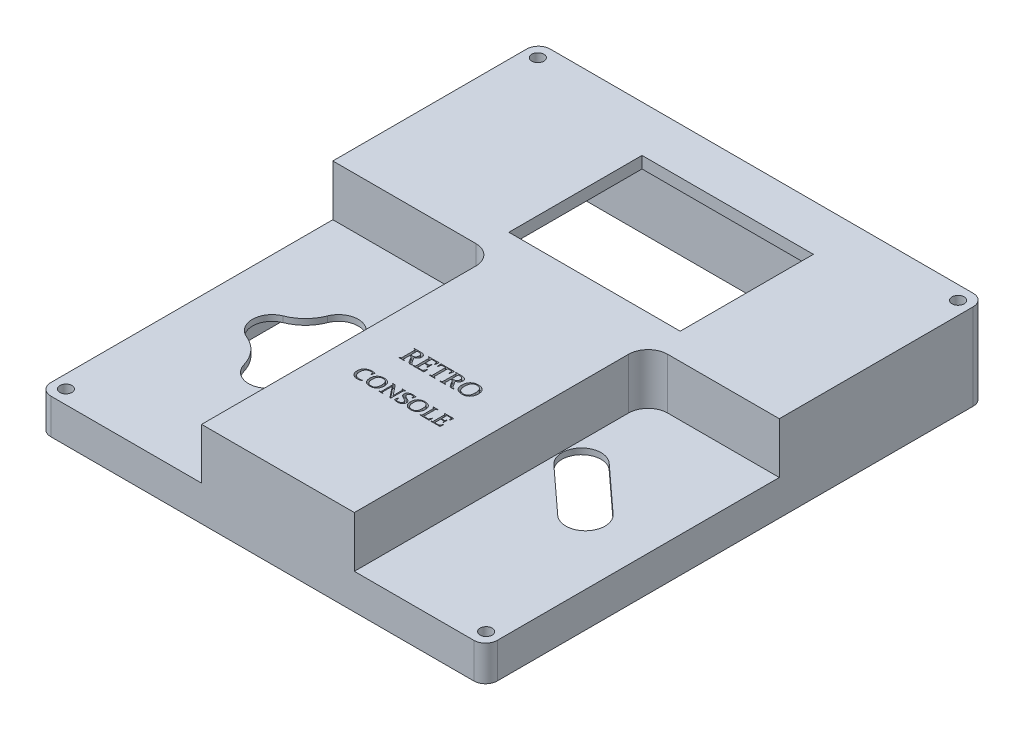
from build123d import *

# Parameters (mm, degrees)
CROQUIS2_W              = 104
CROQUIS2_H              = 22
SALIENTE_EXTRUIR1_DEPTH = 122.5
CROQUIS3_W              = 36.5
CROQUIS3_H              = 13
CROQUIS3_W_2            = 28.5
CORTAR_EXTRUIR1_DEPTH   = 75
CROQUIS5_W              = 100
CROQUIS5_H              = 118.5
CORTAR_EXTRUIR3_DEPTH   = 7.5
CORTAR_EXTRUIR5_DEPTH   = 10
REDONDEO1_R             = 5
REDONDEO2_R             = 5
CORTAR_EXTRUIR6_DEPTH   = 7.5
CORTAR_EXTRUIR7_DEPTH   = 7.5
CROQUIS12_W             = 43.75
CROQUIS12_H             = 34
CORTAR_EXTRUIR8_DEPTH   = 7.5
CORTAR_EXTRUIR9_DEPTH   = 3
SALIENTE_EXTRUIR3_DEPTH = 5
SALIENTE_EXTRUIR4_DEPTH = 5
CROQUIS33_W             = 114
CROQUIS33_H             = 22
SALIENTE_EXTRUIR5_DEPTH = 5
REDONDEO3_R             = 3
CROQUIS34_R             = 1.55
CORTAR_EXTRUIR10_DEPTH  = 170.178160529
CROQUIS35_W             = 46.75
CROQUIS35_H             = 37
CROQUIS35_W_2           = 43.75
CROQUIS35_H_2           = 34
SALIENTE_EXTRUIR6_DEPTH = 1.5
CORTAR_EXTRUIR11_DEPTH  = 1


with BuildPart() as part:
    # Croquis2 → Saliente-Extruir1 (new body)
    with BuildSketch(Plane.XY):
        with Locations((52, 11)):
            Rectangle(CROQUIS2_W, CROQUIS2_H)
    extrude(amount=-SALIENTE_EXTRUIR1_DEPTH)

    # Croquis3 → Cortar-Extruir1 (cut)
    with BuildSketch(Plane.XY):
        with Locations((18.25, 15.5)):
            Rectangle(CROQUIS3_W, CROQUIS3_H)
        with Locations((89.75, 15.5)):
            Rectangle(CROQUIS3_W_2, CROQUIS3_H)
    extrude(amount=-CORTAR_EXTRUIR1_DEPTH, mode=Mode.SUBTRACT)

    # Croquis5 → Cortar-Extruir3 (cut)
    with BuildSketch(Plane.XZ):
        with Locations((52, -61.25)):
            Rectangle(CROQUIS5_W, CROQUIS5_H)
    extrude(amount=-CORTAR_EXTRUIR3_DEPTH, mode=Mode.SUBTRACT)

    # Croquis7 → Cortar-Extruir5 (cut)
    with BuildSketch(Plane.XZ.offset(-7.5)):
        Polygon((2, -77), (38.5, -77), (38.5, -2), (73.5, -2), (73.5, -77), (102, -77), (102, -120.5), (2, -120.5), align=None)
    extrude(amount=-CORTAR_EXTRUIR5_DEPTH, mode=Mode.SUBTRACT)

    # Redondeo1
    redondeo1_edges = [part.edges().sort_by_distance(p)[0] for p in [
        (36.5, 15.5, -75),
    ]]
    fillet(redondeo1_edges, radius=REDONDEO1_R)

    # Redondeo2
    redondeo2_edges = [part.edges().sort_by_distance(p)[0] for p in [
        (75.5, 15.5, -75),
    ]]
    fillet(redondeo2_edges, radius=REDONDEO2_R)

    # Croquis10 → Cortar-Extruir6 (cut)
    with BuildSketch(Plane(origin=(0, 9, 0), x_dir=(1, 0, 0), z_dir=(0, 1, 0))):
        with BuildLine():
            Line((77.37493269, 49.06097294), (89.12493269, 38.31097294))
            ThreePointArc((89.12493269, 38.31097294), (96.18902706, 38.62493269), (95.87506731, 45.68902706))
            Line((95.87506731, 45.68902706), (84.12506731, 56.43902706))
            ThreePointArc((84.12506731, 56.43902706), (77.06097294, 56.12506731), (77.37493269, 49.06097294))
        make_face()
    extrude(amount=-CORTAR_EXTRUIR6_DEPTH, mode=Mode.SUBTRACT)

    # Croquis11 → Cortar-Extruir7 (cut)
    with BuildSketch(Plane(origin=(0, 9, 0), x_dir=(1, 0, 0), z_dir=(0, 1, 0))):
        with BuildLine():
            ThreePointArc((24.956446437, 52.928005313), (20.321889984, 56.239483156), (15.594034712, 53.062631954))
            ThreePointArc((15.594034712, 53.062631954), (13.353171949, 49.636828051), (9.927368046, 47.395965288))
            ThreePointArc((9.927368046, 47.395965288), (6.750124781, 42.775324181), (9.861764365, 38.110252039))
            ThreePointArc((9.861764365, 38.110252039), (13.524307806, 35.53364921), (15.695097698, 31.616918705))
            ThreePointArc((15.695097698, 31.616918705), (20.518032057, 28.000032516), (25.31475317, 31.651611365))
            ThreePointArc((25.31475317, 31.651611365), (27.295147529, 35.396191554), (30.648086504, 37.984944699))
            ThreePointArc((30.648086504, 37.984944699), (33.49889561, 42.60508417), (30.456446437, 47.101338647))
            ThreePointArc((30.456446437, 47.101338647), (27.0973621, 49.439735391), (24.956446437, 52.928005313))
        make_face()
    extrude(amount=-CORTAR_EXTRUIR7_DEPTH, mode=Mode.SUBTRACT)

    # Croquis12 → Cortar-Extruir8 (cut)
    with BuildSketch(Plane(origin=(0, 22, 0), x_dir=(1, 0, 0), z_dir=(0, 1, 0))):
        with Locations((55.125, 98.7)):
            Rectangle(CROQUIS12_W, CROQUIS12_H)
    extrude(amount=-CORTAR_EXTRUIR8_DEPTH, mode=Mode.SUBTRACT)

    # Croquis30 → Cortar-Extruir9 (cut)
    with BuildSketch(Plane.XZ.offset(-17.5)):
        Polygon((38.5, -2), (73.5, -2), (73.5, -77), (102, -77), (102, -120.5), (2, -120.5), (2, -77), (38.5, -77), align=None)
    extrude(amount=-CORTAR_EXTRUIR9_DEPTH, mode=Mode.SUBTRACT)

    # Croquis31 → Saliente-Extruir3 (add)
    with BuildSketch(Plane(origin=(104, 0, 0), x_dir=(0, 0, -1), z_dir=(1, 0, 0))):
        Polygon((122.5, 0), (122.5, 22), (75, 22), (75, 9), (0, 9), (0, 0), align=None)
    extrude(amount=SALIENTE_EXTRUIR3_DEPTH)

    # Croquis32 → Saliente-Extruir4 (add)
    with BuildSketch(Plane.ZY):
        Polygon((0, 0), (-122.5, 0), (-122.5, 22), (-75, 22), (-75, 9), (0, 9), align=None)
    extrude(amount=SALIENTE_EXTRUIR4_DEPTH)

    # Croquis33 → Saliente-Extruir5 (add)
    with BuildSketch(Plane(origin=(0, 0, -122.5), x_dir=(-1, 0, 0), z_dir=(0, 0, -1))):
        with Locations((-52, 11)):
            Rectangle(CROQUIS33_W, CROQUIS33_H)
    extrude(amount=SALIENTE_EXTRUIR5_DEPTH)

    # Redondeo3
    redondeo3_edges = [part.edges().sort_by_distance(p)[0] for p in [
        (109, 4.5, 0),
        (-5, 4.5, 0),
        (-5, 11, -127.5),
        (109, 11, -127.5),
    ]]
    fillet(redondeo3_edges, radius=REDONDEO3_R)

    # Croquis34 → Cortar-Extruir10 (cut, through all)
    with BuildSketch(Plane(origin=(0, 22, 0), x_dir=(1, 0, 0), z_dir=(0, 1, 0))):
        with Locations(Location((-1.65, 124, 0), (0, 0, 180))):
            Circle(CROQUIS34_R)
        with Locations(Location((105.65, 3.5, 0), (0, 0, 180))):
            Circle(CROQUIS34_R)
        with Locations(Location((-1.65, 3.5, 0), (0, 0, 180))):
            Circle(CROQUIS34_R)
        with Locations(Location((105.65, 124, 0), (0, 0, 180))):
            Circle(CROQUIS34_R)
    extrude(amount=-CORTAR_EXTRUIR10_DEPTH, mode=Mode.SUBTRACT)

    # Croquis35 → Saliente-Extruir6 (add)
    with BuildSketch(Plane.XZ.offset(-20.5)):
        with Locations((55.125, -98.7)):
            Rectangle(CROQUIS35_W, CROQUIS35_H)
        with Locations((55.125, -98.7)):
            Rectangle(CROQUIS35_W_2, CROQUIS35_H_2, mode=Mode.SUBTRACT)
    extrude(amount=SALIENTE_EXTRUIR6_DEPTH)

    # Croquis36 → Cortar-Extruir11 (cut)
    # profile 1 of 12: a face of its own
    with BuildSketch(Plane(origin=(0, 22, 0), x_dir=(1, 0, 0), z_dir=(0, 1, 0))):
        with BuildLine():
            add(Edge.make_bspline(
                [(47.84, 40.7975), (47.840289781, 40.744722294), (47.840840367, 40.644444498), (47.84143922, 40.501662611), (47.843034686, 40.373322876), (47.844933021, 40.292498698), (47.845833333, 40.254166667)],
                knots=[0, 0, 0, 0, 1.16556873, 2.214583996, 3.153240739, 4, 4, 4, 4], degree=3))
            add(Edge.make_bspline(
                [(47.845833333, 40.254166667), (47.847040031, 40.240952778), (47.849303876, 40.216162638), (47.863744146, 40.18295724), (47.887535523, 40.15753624), (47.908427304, 40.149256287), (47.919166667, 40.145)],
                knots=[0, 0, 0, 0, 1.12342583, 2.107622107, 3.027228327, 4, 4, 4, 4], degree=3))
            Line((47.919166667, 40.145), (48.230833333, 40.053333333))
            Line((48.230833333, 40.053333333), (48.24, 39.946666667))
            add(Edge.make_bspline(
                [(48.24, 39.946666667), (48.129171912, 39.949306421), (47.90892514, 39.954552361), (47.688616224, 39.954851425), (47.579166667, 39.955)],
                knots=[0, 0, 0, 0, 1.006399206, 2, 2, 2, 2], degree=3))
            add(Edge.make_bspline(
                [(47.579166667, 39.955), (47.466384228, 39.954833997), (47.23663282, 39.954495828), (47.006939432, 39.949307898), (46.89, 39.946666667)],
                knots=[0, 0, 0, 0, 0.98177799, 2, 2, 2, 2], degree=3))
            Line((46.89, 39.946666667), (46.879166667, 40.053333333))
            Line((46.879166667, 40.053333333), (47.225, 40.16))
            add(Edge.make_bspline(
                [(47.225, 40.16), (47.235577409, 40.163860436), (47.255662726, 40.171190974), (47.28020545, 40.191076724), (47.296580141, 40.217865308), (47.299367184, 40.238376547), (47.300833333, 40.249166667)],
                knots=[0, 0, 0, 0, 1.072356029, 2.036284212, 2.966969876, 4, 4, 4, 4], degree=3))
            add(Edge.make_bspline(
                [(47.300833333, 40.249166667), (47.301754781, 40.289720833), (47.303698519, 40.375267389), (47.304914492, 40.510834152), (47.307177195, 40.660827211), (47.306842157, 40.76583229), (47.306666667, 40.820833333)],
                knots=[0, 0, 0, 0, 0.851424291, 1.796027954, 2.845572385, 4, 4, 4, 4], degree=3))
            Line((47.306666667, 40.820833333), (47.306666667, 43.1525))
            add(Edge.make_bspline(
                [(47.306666667, 43.1525), (47.306845373, 43.198890167), (47.307184609, 43.286951852), (47.30491364, 43.412498986), (47.303705286, 43.525290424), (47.301755166, 43.596390571), (47.300833333, 43.63)],
                knots=[0, 0, 0, 0, 1.165661162, 2.212755269, 3.155159611, 4, 4, 4, 4], degree=3))
            add(Edge.make_bspline(
                [(47.300833333, 43.63), (47.29993469, 43.641582755), (47.298240687, 43.663417021), (47.283796256, 43.692312683), (47.262478425, 43.715555225), (47.243216826, 43.723449366), (47.233333333, 43.7275)],
                knots=[0, 0, 0, 0, 1.089053236, 2.052937975, 3.000925474, 4, 4, 4, 4], degree=3))
            Line((47.233333333, 43.7275), (46.885, 43.84))
            Line((46.885, 43.84), (46.879166667, 43.946666667))
            add(Edge.make_bspline(
                [(46.879166667, 43.946666667), (46.998881522, 43.943402259), (47.23633817, 43.936927245), (47.473881763, 43.936195945), (47.591666667, 43.935833333)],
                knots=[0, 0, 0, 0, 1.008309156, 2, 2, 2, 2], degree=3))
            add(Edge.make_bspline(
                [(47.591666667, 43.935833333), (47.617780944, 43.935969106), (47.676138681, 43.936272519), (47.773888335, 43.940347595), (47.892465242, 43.944910035), (47.97888307, 43.94604827), (48.025833333, 43.946666667)],
                knots=[0, 0, 0, 0, 0.721468326, 1.612269701, 2.702761104, 4, 4, 4, 4], degree=3))
            add(Edge.make_bspline(
                [(48.025833333, 43.946666667), (48.073333333, 43.946666667), (48.159444444, 43.946666667), (48.276666667, 43.946666667), (48.37, 43.946666667), (48.424722222, 43.946666667), (48.448333333, 43.946666667)],
                knots=[0, 0, 0, 0, 1.349112426, 2.445759369, 3.32938856, 4, 4, 4, 4], degree=3))
            add(Edge.make_bspline(
                [(48.448333333, 43.946666667), (48.501411392, 43.945860972), (48.604090637, 43.944302359), (48.752958101, 43.932521014), (48.891574459, 43.913569968), (49.020211586, 43.887526418), (49.138349597, 43.852359507), (49.246352468, 43.80991366), (49.344707974, 43.760357253), (49.431661341, 43.701348125), (49.509347279, 43.636214909), (49.576274054, 43.563182518), (49.633639059, 43.483317919), (49.680646412, 43.396042721), (49.716570067, 43.301283602), (49.740871501, 43.199560925), (49.757674519, 43.091387254), (49.759210088, 43.016735118), (49.76, 42.978333333)],
                knots=[0, 0, 0, 0, 1.373939338, 2.657878926, 3.862977708, 4.994036763, 6.051984536, 7.049479102, 7.994998342, 8.896479064, 9.763814478, 10.613714993, 11.453824405, 12.303207606, 13.172627177, 14.069074787, 15.006713304, 16, 16, 16, 16], degree=3))
            add(Edge.make_bspline(
                [(49.76, 42.978333333), (49.759424123, 42.943586841), (49.758292455, 42.875305713), (49.747525378, 42.775453245), (49.72862118, 42.680975455), (49.705329269, 42.590945409), (49.672150647, 42.50677234), (49.633220665, 42.426902811), (49.586090845, 42.352689245), (49.532704151, 42.282798203), (49.470944044, 42.218695568), (49.403105314, 42.157217015), (49.327424713, 42.099805621), (49.243304961, 42.047446269), (49.152429202, 41.998504583), (49.054492745, 41.952238891), (48.94864621, 41.91065557), (48.874590015, 41.887075229), (48.836666667, 41.875)],
                knots=[0, 0, 0, 0, 1.066375877, 2.09555964, 3.077161004, 4.022426913, 4.945591025, 5.849334685, 6.745930503, 7.639602367, 8.544310879, 9.474066861, 10.447822873, 11.455591219, 12.512413436, 13.614760254, 14.778545442, 16, 16, 16, 16], degree=3))
            add(Edge.make_bspline(
                [(48.836666667, 41.875), (48.896121374, 41.78675577), (49.012079111, 41.61464827), (49.171487039, 41.358004546), (49.320929597, 41.118222884), (49.438122869, 40.930072012), (49.527014973, 40.790797972), (49.58957669, 40.695181083), (49.648601293, 40.605368773), (49.70398101, 40.521604003), (49.758099528, 40.446161893), (49.80927484, 40.378245173), (49.8596051, 40.319720534), (49.893201289, 40.284321917), (49.909166667, 40.2675)],
                knots=[0, 0, 0, 0, 1.979920897, 3.861546963, 5.621521729, 7.237935787, 7.986456609, 8.696166828, 9.364277827, 9.986498717, 10.564574258, 11.09186048, 11.568439417, 12, 12, 12, 12], degree=3))
            add(Edge.make_bspline(
                [(49.909166667, 40.2675), (49.924769682, 40.252253156), (49.954928189, 40.22278308), (50.002807602, 40.183731423), (50.052458616, 40.151977653), (50.103983187, 40.125365468), (50.158655903, 40.105726954), (50.215169914, 40.085367634), (50.276809565, 40.069431231), (50.319439177, 40.058850321), (50.341666667, 40.053333333)],
                knots=[0, 0, 0, 0, 1.066453224, 2.06130902, 3.01449663, 3.943871608, 4.889773601, 5.851918761, 6.879969814, 8, 8, 8, 8], degree=3))
            Line((50.341666667, 40.053333333), (50.35, 39.965))
            add(Edge.make_bspline(
                [(50.35, 39.965), (50.317518725, 39.961947092), (50.255669938, 39.956133938), (50.16638512, 39.952075623), (50.085613555, 39.946777497), (50.034174465, 39.9467021), (50.01, 39.946666667)],
                knots=[0, 0, 0, 0, 1.149186279, 2.188207784, 3.148524834, 4, 4, 4, 4], degree=3))
            add(Edge.make_bspline(
                [(50.01, 39.946666667), (49.973891827, 39.947163604), (49.906103827, 39.948096533), (49.810361223, 39.950288573), (49.726001797, 39.958725558), (49.650777876, 39.971470778), (49.583604274, 39.991354605), (49.521382238, 40.014318241), (49.463602659, 40.045315247), (49.42755785, 40.069937143), (49.409166667, 40.0825)],
                knots=[0, 0, 0, 0, 1.380324856, 2.591365151, 3.658322977, 4.618350237, 5.502084813, 6.33215299, 7.149012595, 8, 8, 8, 8], degree=3))
            add(Edge.make_bspline(
                [(49.409166667, 40.0825), (49.388851964, 40.097672183), (49.346795474, 40.129082378), (49.287539371, 40.1857341), (49.229683803, 40.251963587), (49.149638292, 40.354040509), (49.0516949, 40.499884289), (48.930270397, 40.689430152), (48.80492382, 40.8961288), (48.674922036, 41.114495243), (48.540056924, 41.338155891), (48.441745885, 41.483740529), (48.3925, 41.556666667)],
                knots=[0, 0, 0, 0, 0.422669588, 0.875031247, 1.364135484, 1.888822465, 3.037944898, 4.292504576, 5.644318377, 7.070000119, 8.532306861, 10, 10, 10, 10], degree=3))
            add(Edge.make_bspline(
                [(48.3925, 41.556666667), (48.37907959, 41.576252717), (48.35513477, 41.611198329), (48.319920797, 41.657109576), (48.287718655, 41.693825576), (48.251627054, 41.720354219), (48.210892305, 41.739414064), (48.16331638, 41.750710951), (48.106253813, 41.756785361), (48.0647372, 41.758851731), (48.041666667, 41.76)],
                knots=[0, 0, 0, 0, 1.317495967, 2.350688577, 3.212640675, 4.017539648, 4.817698653, 5.692790188, 6.71789732, 8, 8, 8, 8], degree=3))
            Line((48.041666667, 41.76), (47.84, 41.765))
            Line((47.84, 41.765), (47.84, 40.7975))
        make_face()
        with BuildLine():
            add(Edge.make_bspline(
                [(47.84, 42.035), (47.896104243, 42.032785033), (48.003844553, 42.0285315), (48.111660849, 42.027270851), (48.163333333, 42.026666667)],
                knots=[0, 0, 0, 0, 1.041471719, 2, 2, 2, 2], degree=3))
            add(Edge.make_bspline(
                [(48.163333333, 42.026666667), (48.20334976, 42.027344588), (48.280714544, 42.028655232), (48.392385576, 42.037579735), (48.495768966, 42.053264058), (48.590752463, 42.075741001), (48.678035441, 42.103714703), (48.756989625, 42.138679962), (48.827335681, 42.180566749), (48.890243021, 42.228444194), (48.944632459, 42.283959855), (48.991804765, 42.346493329), (49.032052935, 42.416071718), (49.064399022, 42.493158256), (49.089249356, 42.577352317), (49.10755034, 42.668505188), (49.11839557, 42.766958741), (49.119454591, 42.834972204), (49.12, 42.87)],
                knots=[0, 0, 0, 0, 1.305684408, 2.524313152, 3.652377692, 4.714230734, 5.705956491, 6.639127356, 7.525153036, 8.371777779, 9.21138698, 10.052511415, 10.921545616, 11.827241249, 12.773525228, 13.78139704, 14.857391325, 16, 16, 16, 16], degree=3))
            add(Edge.make_bspline(
                [(49.12, 42.87), (49.119504989, 42.903926321), (49.118544679, 42.969742608), (49.107054995, 43.064653392), (49.091047853, 43.152972455), (49.06710949, 43.234187011), (49.035095945, 43.307664786), (48.997610787, 43.374756236), (48.95210287, 43.434143657), (48.900025804, 43.487379807), (48.840231924, 43.533517793), (48.772778787, 43.572690137), (48.697921188, 43.606160965), (48.615312339, 43.633561958), (48.524551806, 43.654105475), (48.426223167, 43.668811428), (48.320174547, 43.678066051), (48.246964116, 43.679341503), (48.209166667, 43.68)],
                knots=[0, 0, 0, 0, 1.157306971, 2.245149082, 3.258555241, 4.21843618, 5.127231179, 5.98922298, 6.834949821, 7.672989047, 8.524488835, 9.404183157, 10.329300276, 11.318694509, 12.369721108, 13.501423902, 14.710022588, 16, 16, 16, 16], degree=3))
            add(Edge.make_bspline(
                [(48.209166667, 43.68), (48.181661886, 43.679601236), (48.124403348, 43.678771103), (48.035497843, 43.674312144), (47.939873127, 43.667879379), (47.874147948, 43.661048847), (47.84, 43.6575)],
                knots=[0, 0, 0, 0, 0.892071271, 1.8570843, 2.886634063, 4, 4, 4, 4], degree=3))
            Line((47.84, 43.6575), (47.84, 42.035))
        make_face(mode=Mode.SUBTRACT)
    # profile 2 of 12: a face of its own
    with BuildSketch(Plane(origin=(0, 22, 0), x_dir=(1, 0, 0), z_dir=(0, 1, 0))):
        with BuildLine():
            Line((51.194166667, 43.946666667), (51.869166667, 43.946666667))
            add(Edge.make_bspline(
                [(51.869166667, 43.946666667), (51.975555656, 43.946902561), (52.191390229, 43.947381128), (52.519450368, 43.948894571), (52.856399432, 43.952225858), (53.08389034, 43.955726249), (53.199166667, 43.9575)],
                knots=[0, 0, 0, 0, 0.95986119, 1.947299551, 2.95983638, 4, 4, 4, 4], degree=3))
            Line((53.199166667, 43.9575), (53.216666667, 43.935))
            Line((53.216666667, 43.935), (53.053333333, 43.04))
            Line((53.053333333, 43.04), (52.940833333, 43.020833333))
            Line((52.940833333, 43.020833333), (52.766666667, 43.733333333))
            Line((52.766666667, 43.733333333), (51.466666667, 43.733333333))
            Line((51.466666667, 43.733333333), (51.466666667, 42.133333333))
            Line((51.466666667, 42.133333333), (51.7225, 42.133333333))
            add(Edge.make_bspline(
                [(51.7225, 42.133333333), (51.772778726, 42.133168488), (51.875839148, 42.132830593), (52.034716227, 42.135513185), (52.201954353, 42.135326639), (52.316390568, 42.137314985), (52.375, 42.138333333)],
                knots=[0, 0, 0, 0, 0.924608237, 1.895245239, 2.922032839, 4, 4, 4, 4], degree=3))
            add(Edge.make_bspline(
                [(52.375, 42.138333333), (52.386282429, 42.139284963), (52.407794775, 42.141099448), (52.436444049, 42.155119597), (52.45907745, 42.177162867), (52.466791623, 42.196523165), (52.470833333, 42.206666667)],
                knots=[0, 0, 0, 0, 1.068716211, 2.037734312, 2.971903963, 4, 4, 4, 4], degree=3))
            Line((52.470833333, 42.206666667), (52.569166667, 42.56))
            Line((52.569166667, 42.56), (52.721666667, 42.565833333))
            add(Edge.make_bspline(
                [(52.721666667, 42.565833333), (52.72016677, 42.505002173), (52.717379462, 42.391957615), (52.715110727, 42.235280127), (52.713276706, 42.104170123), (52.712739999, 42.02527817), (52.7125, 41.99)],
                knots=[0, 0, 0, 0, 1.267879065, 2.356141637, 3.264914697, 4, 4, 4, 4], degree=3))
            add(Edge.make_bspline(
                [(52.7125, 41.99), (52.712741318, 41.95555517), (52.713284297, 41.87805212), (52.715112265, 41.748886537), (52.717382306, 41.593875644), (52.720167079, 41.481942256), (52.721666667, 41.421666667)],
                knots=[0, 0, 0, 0, 0.727191112, 1.636226109, 2.727119176, 4, 4, 4, 4], degree=3))
            Line((52.721666667, 41.421666667), (52.569166667, 41.410833333))
            Line((52.569166667, 41.410833333), (52.468333333, 41.830833333))
            add(Edge.make_bspline(
                [(52.468333333, 41.830833333), (52.464202612, 41.842772328), (52.456552849, 41.864882388), (52.437142003, 41.892168173), (52.410994286, 41.909898319), (52.391091746, 41.912714906), (52.380833333, 41.914166667)],
                knots=[0, 0, 0, 0, 1.165841965, 2.159045699, 3.051112636, 4, 4, 4, 4], degree=3))
            add(Edge.make_bspline(
                [(52.380833333, 41.914166667), (52.321389794, 41.915083141), (52.205283296, 41.916873221), (52.035553744, 41.918098877), (51.874727447, 41.92043343), (51.770556322, 41.920141621), (51.72, 41.92)],
                knots=[0, 0, 0, 0, 1.079495133, 2.108494915, 3.082014899, 4, 4, 4, 4], degree=3))
            Line((51.72, 41.92), (51.466666667, 41.92))
            Line((51.466666667, 41.92), (51.466666667, 40.820833333))
            add(Edge.make_bspline(
                [(51.466666667, 40.820833333), (51.467008172, 40.709998105), (51.467686927, 40.489709125), (51.470902364, 40.269442597), (51.4725, 40.16)],
                knots=[0, 0, 0, 0, 1.006271195, 2, 2, 2, 2], degree=3))
            Line((51.4725, 40.16), (52.8225, 40.16))
            Line((52.8225, 40.16), (53.165833333, 40.94))
            Line((53.165833333, 40.94), (53.2925, 40.9625))
            Line((53.2925, 40.9625), (53.23, 39.958333333))
            Line((53.23, 39.958333333), (53.210833333, 39.938333333))
            add(Edge.make_bspline(
                [(53.210833333, 39.938333333), (53.091666148, 39.939367029), (52.858331354, 39.941391053), (52.515287054, 39.945675917), (52.186387845, 39.945651497), (51.971666334, 39.946333275), (51.866666667, 39.946666667)],
                knots=[0, 0, 0, 0, 1.063875567, 2.083116964, 3.062636615, 4, 4, 4, 4], degree=3))
            Line((51.866666667, 39.946666667), (51.205833333, 39.946666667))
            add(Edge.make_bspline(
                [(51.205833333, 39.946666667), (51.093055556, 39.946666667), (50.863333333, 39.946666667), (50.633611111, 39.946666667), (50.516666667, 39.946666667)],
                knots=[0, 0, 0, 0, 0.981862152, 2, 2, 2, 2], degree=3))
            Line((50.516666667, 39.946666667), (50.505833333, 40.053333333))
            Line((50.505833333, 40.053333333), (50.851666667, 40.16))
            add(Edge.make_bspline(
                [(50.851666667, 40.16), (50.862244076, 40.163860436), (50.882329393, 40.171190974), (50.906872117, 40.191076724), (50.923246807, 40.217865308), (50.926033851, 40.238376547), (50.9275, 40.249166667)],
                knots=[0, 0, 0, 0, 1.072356029, 2.036284212, 2.966969876, 4, 4, 4, 4], degree=3))
            add(Edge.make_bspline(
                [(50.9275, 40.249166667), (50.928421448, 40.289720833), (50.930365186, 40.375267389), (50.931581159, 40.510834152), (50.933843861, 40.660827211), (50.933508824, 40.76583229), (50.933333333, 40.820833333)],
                knots=[0, 0, 0, 0, 0.851424291, 1.796027954, 2.845572385, 4, 4, 4, 4], degree=3))
            Line((50.933333333, 40.820833333), (50.933333333, 43.1525))
            add(Edge.make_bspline(
                [(50.933333333, 43.1525), (50.93351204, 43.198890167), (50.933851276, 43.286951852), (50.931580306, 43.412498986), (50.930371952, 43.525290424), (50.928421832, 43.596390571), (50.9275, 43.63)],
                knots=[0, 0, 0, 0, 1.165661162, 2.212755269, 3.155159611, 4, 4, 4, 4], degree=3))
            add(Edge.make_bspline(
                [(50.9275, 43.63), (50.926601356, 43.641582755), (50.924907353, 43.663417021), (50.910462922, 43.692312683), (50.889145092, 43.715555225), (50.869883493, 43.723449366), (50.86, 43.7275)],
                knots=[0, 0, 0, 0, 1.089053236, 2.052937975, 3.000925474, 4, 4, 4, 4], degree=3))
            Line((50.86, 43.7275), (50.511666667, 43.84))
            Line((50.511666667, 43.84), (50.505833333, 43.946666667))
            add(Edge.make_bspline(
                [(50.505833333, 43.946666667), (50.623611111, 43.946666667), (50.853055556, 43.946666667), (51.0825, 43.946666667), (51.194166667, 43.946666667)],
                knots=[0, 0, 0, 0, 1.026634383, 2, 2, 2, 2], degree=3))
        make_face()
    # profile 3 of 12: a face of its own
    with BuildSketch(Plane(origin=(0, 22, 0), x_dir=(1, 0, 0), z_dir=(0, 1, 0))):
        with BuildLine():
            add(Edge.make_bspline(
                [(55.365833333, 39.955), (55.307778339, 39.954668734), (55.188612891, 39.953988769), (55.004428366, 39.953982761), (54.810281379, 39.949716792), (54.677223159, 39.947698818), (54.609166667, 39.946666667)],
                knots=[0, 0, 0, 0, 0.920642888, 1.889739583, 2.920646004, 4, 4, 4, 4], degree=3))
            Line((54.609166667, 39.946666667), (54.598333333, 40.053333333))
            Line((54.598333333, 40.053333333), (55.014166667, 40.180833333))
            add(Edge.make_bspline(
                [(55.014166667, 40.180833333), (55.024750263, 40.184662492), (55.045016104, 40.191994699), (55.069362868, 40.2123057), (55.083870214, 40.239932196), (55.086239628, 40.260103518), (55.0875, 40.270833333)],
                knots=[0, 0, 0, 0, 1.07619582, 2.060737424, 2.968439932, 4, 4, 4, 4], degree=3))
            add(Edge.make_bspline(
                [(55.0875, 40.270833333), (55.088422575, 40.310276337), (55.09038452, 40.394155717), (55.091578416, 40.527500901), (55.093848543, 40.676104874), (55.093510771, 40.780276705), (55.093333333, 40.835)],
                knots=[0, 0, 0, 0, 0.839114093, 1.784457676, 2.836136637, 4, 4, 4, 4], degree=3))
            Line((55.093333333, 40.835), (55.093333333, 43.733333333))
            Line((55.093333333, 43.733333333), (54.1, 43.733333333))
            Line((54.1, 43.733333333), (53.85, 42.9325))
            Line((53.85, 42.9325), (53.7375, 42.911666667))
            Line((53.7375, 42.911666667), (53.664166667, 43.935))
            Line((53.664166667, 43.935), (53.684166667, 43.9575))
            add(Edge.make_bspline(
                [(53.684166667, 43.9575), (53.798331854, 43.955724923), (54.024155891, 43.952213737), (54.35916072, 43.948892992), (54.686665312, 43.947377905), (54.902499897, 43.946901908), (55.009166667, 43.946666667)],
                knots=[0, 0, 0, 0, 1.034026858, 2.045353098, 3.034001568, 4, 4, 4, 4], degree=3))
            Line((55.009166667, 43.946666667), (55.7425, 43.946666667))
            add(Edge.make_bspline(
                [(55.7425, 43.946666667), (55.848888989, 43.946902561), (56.064723563, 43.947381128), (56.392783702, 43.948894571), (56.729732765, 43.952225858), (56.957223674, 43.955726249), (57.0725, 43.9575)],
                knots=[0, 0, 0, 0, 0.95986119, 1.947299551, 2.95983638, 4, 4, 4, 4], degree=3))
            Line((57.0725, 43.9575), (57.089166667, 43.935))
            Line((57.089166667, 43.935), (56.9125, 42.931666667))
            Line((56.9125, 42.931666667), (56.8, 42.911666667))
            Line((56.8, 42.911666667), (56.62, 43.733333333))
            Line((56.62, 43.733333333), (55.626666667, 43.733333333))
            Line((55.626666667, 43.733333333), (55.626666667, 40.835))
            add(Edge.make_bspline(
                [(55.626666667, 40.835), (55.626489229, 40.780276705), (55.626151457, 40.676104874), (55.628421584, 40.527500901), (55.62961548, 40.394155717), (55.631577425, 40.310276337), (55.6325, 40.270833333)],
                knots=[0, 0, 0, 0, 1.163863363, 2.215542324, 3.160885907, 4, 4, 4, 4], degree=3))
            add(Edge.make_bspline(
                [(55.6325, 40.270833333), (55.633670464, 40.260046953), (55.635885454, 40.239634776), (55.651618137, 40.212843209), (55.67495852, 40.191704975), (55.695172677, 40.184587165), (55.705833333, 40.180833333)],
                knots=[0, 0, 0, 0, 1.033432821, 1.955671374, 2.921850393, 4, 4, 4, 4], degree=3))
            Line((55.705833333, 40.180833333), (56.121666667, 40.053333333))
            Line((56.121666667, 40.053333333), (56.1275, 39.946666667))
            add(Edge.make_bspline(
                [(56.1275, 39.946666667), (56.05722117, 39.947690217), (55.921106874, 39.949672603), (55.723904707, 39.953972629), (55.540276026, 39.953983519), (55.422499464, 39.954669805), (55.365833333, 39.955)],
                knots=[0, 0, 0, 0, 1.107274464, 2.144541755, 3.107278743, 4, 4, 4, 4], degree=3))
        make_face()
    # profile 4 of 12: a face of its own
    with BuildSketch(Plane(origin=(0, 22, 0), x_dir=(1, 0, 0), z_dir=(0, 1, 0))):
        with BuildLine():
            add(Edge.make_bspline(
                [(58.346666667, 40.7975), (58.346956448, 40.744722294), (58.347507033, 40.644444498), (58.348105887, 40.501662611), (58.349701353, 40.373322876), (58.351599688, 40.292498698), (58.3525, 40.254166667)],
                knots=[0, 0, 0, 0, 1.16556873, 2.214583996, 3.153240739, 4, 4, 4, 4], degree=3))
            add(Edge.make_bspline(
                [(58.3525, 40.254166667), (58.353706697, 40.240952778), (58.355970542, 40.216162638), (58.370410813, 40.18295724), (58.39420219, 40.15753624), (58.415093971, 40.149256287), (58.425833333, 40.145)],
                knots=[0, 0, 0, 0, 1.12342583, 2.107622107, 3.027228327, 4, 4, 4, 4], degree=3))
            Line((58.425833333, 40.145), (58.7375, 40.053333333))
            Line((58.7375, 40.053333333), (58.746666667, 39.946666667))
            add(Edge.make_bspline(
                [(58.746666667, 39.946666667), (58.635838579, 39.949306421), (58.415591807, 39.954552361), (58.19528289, 39.954851425), (58.085833333, 39.955)],
                knots=[0, 0, 0, 0, 1.006399206, 2, 2, 2, 2], degree=3))
            add(Edge.make_bspline(
                [(58.085833333, 39.955), (57.973050895, 39.954833997), (57.743299486, 39.954495828), (57.513606098, 39.949307898), (57.396666667, 39.946666667)],
                knots=[0, 0, 0, 0, 0.98177799, 2, 2, 2, 2], degree=3))
            Line((57.396666667, 39.946666667), (57.385833333, 40.053333333))
            Line((57.385833333, 40.053333333), (57.731666667, 40.16))
            add(Edge.make_bspline(
                [(57.731666667, 40.16), (57.742244076, 40.163860436), (57.762329393, 40.171190974), (57.786872117, 40.191076724), (57.803246807, 40.217865308), (57.806033851, 40.238376547), (57.8075, 40.249166667)],
                knots=[0, 0, 0, 0, 1.072356029, 2.036284212, 2.966969876, 4, 4, 4, 4], degree=3))
            add(Edge.make_bspline(
                [(57.8075, 40.249166667), (57.808421448, 40.289720833), (57.810365186, 40.375267389), (57.811581159, 40.510834152), (57.813843861, 40.660827211), (57.813508824, 40.76583229), (57.813333333, 40.820833333)],
                knots=[0, 0, 0, 0, 0.851424291, 1.796027954, 2.845572385, 4, 4, 4, 4], degree=3))
            Line((57.813333333, 40.820833333), (57.813333333, 43.1525))
            add(Edge.make_bspline(
                [(57.813333333, 43.1525), (57.81351204, 43.198890167), (57.813851276, 43.286951852), (57.811580306, 43.412498986), (57.810371952, 43.525290424), (57.808421832, 43.596390571), (57.8075, 43.63)],
                knots=[0, 0, 0, 0, 1.165661162, 2.212755269, 3.155159611, 4, 4, 4, 4], degree=3))
            add(Edge.make_bspline(
                [(57.8075, 43.63), (57.806601356, 43.641582755), (57.804907353, 43.663417021), (57.790462922, 43.692312683), (57.769145092, 43.715555225), (57.749883493, 43.723449366), (57.74, 43.7275)],
                knots=[0, 0, 0, 0, 1.089053236, 2.052937975, 3.000925474, 4, 4, 4, 4], degree=3))
            Line((57.74, 43.7275), (57.391666667, 43.84))
            Line((57.391666667, 43.84), (57.385833333, 43.946666667))
            add(Edge.make_bspline(
                [(57.385833333, 43.946666667), (57.505548189, 43.943402259), (57.743004836, 43.936927245), (57.98054843, 43.936195945), (58.098333333, 43.935833333)],
                knots=[0, 0, 0, 0, 1.008309156, 2, 2, 2, 2], degree=3))
            add(Edge.make_bspline(
                [(58.098333333, 43.935833333), (58.124447611, 43.935969106), (58.182805347, 43.936272519), (58.280555002, 43.940347595), (58.399131909, 43.944910035), (58.485549736, 43.94604827), (58.5325, 43.946666667)],
                knots=[0, 0, 0, 0, 0.721468326, 1.612269701, 2.702761104, 4, 4, 4, 4], degree=3))
            add(Edge.make_bspline(
                [(58.5325, 43.946666667), (58.58, 43.946666667), (58.666111111, 43.946666667), (58.783333333, 43.946666667), (58.876666667, 43.946666667), (58.931388889, 43.946666667), (58.955, 43.946666667)],
                knots=[0, 0, 0, 0, 1.349112426, 2.445759369, 3.32938856, 4, 4, 4, 4], degree=3))
            add(Edge.make_bspline(
                [(58.955, 43.946666667), (59.008078059, 43.945860972), (59.110757304, 43.944302359), (59.259624767, 43.932521014), (59.398241126, 43.913569968), (59.526878253, 43.887526418), (59.645016264, 43.852359507), (59.753019134, 43.80991366), (59.85137464, 43.760357253), (59.938328007, 43.701348125), (60.016013946, 43.636214909), (60.082940721, 43.563182518), (60.140305726, 43.483317919), (60.187313078, 43.396042721), (60.223236733, 43.301283602), (60.247538168, 43.199560925), (60.264341185, 43.091387254), (60.265876755, 43.016735118), (60.266666667, 42.978333333)],
                knots=[0, 0, 0, 0, 1.373939338, 2.657878926, 3.862977708, 4.994036763, 6.051984536, 7.049479102, 7.994998342, 8.896479064, 9.763814478, 10.613714993, 11.453824405, 12.303207606, 13.172627177, 14.069074787, 15.006713304, 16, 16, 16, 16], degree=3))
            add(Edge.make_bspline(
                [(60.266666667, 42.978333333), (60.26609079, 42.943586841), (60.264959121, 42.875305713), (60.254192044, 42.775453245), (60.235287847, 42.680975455), (60.211995936, 42.590945409), (60.178817314, 42.50677234), (60.139887331, 42.426902811), (60.092757511, 42.352689245), (60.039370817, 42.282798203), (59.97761071, 42.218695568), (59.909771981, 42.157217015), (59.83409138, 42.099805621), (59.749971627, 42.047446269), (59.659095869, 41.998504583), (59.561159412, 41.952238891), (59.455312877, 41.91065557), (59.381256682, 41.887075229), (59.343333333, 41.875)],
                knots=[0, 0, 0, 0, 1.066375877, 2.09555964, 3.077161004, 4.022426913, 4.945591025, 5.849334685, 6.745930503, 7.639602367, 8.544310879, 9.474066861, 10.447822873, 11.455591219, 12.512413436, 13.614760254, 14.778545442, 16, 16, 16, 16], degree=3))
            add(Edge.make_bspline(
                [(59.343333333, 41.875), (59.402788041, 41.78675577), (59.518745778, 41.61464827), (59.678153705, 41.358004546), (59.827596263, 41.118222884), (59.944789535, 40.930072012), (60.033681639, 40.790797972), (60.096243357, 40.695181083), (60.155267959, 40.605368773), (60.210647677, 40.521604003), (60.264766195, 40.446161893), (60.315941506, 40.378245173), (60.366271767, 40.319720534), (60.399867955, 40.284321917), (60.415833333, 40.2675)],
                knots=[0, 0, 0, 0, 1.979920897, 3.861546963, 5.621521729, 7.237935787, 7.986456609, 8.696166828, 9.364277827, 9.986498717, 10.564574258, 11.09186048, 11.568439417, 12, 12, 12, 12], degree=3))
            add(Edge.make_bspline(
                [(60.415833333, 40.2675), (60.431436349, 40.252253156), (60.461594856, 40.22278308), (60.509474269, 40.183731423), (60.559125283, 40.151977653), (60.610649853, 40.125365468), (60.66532257, 40.105726954), (60.721836581, 40.085367634), (60.783476232, 40.069431231), (60.826105844, 40.058850321), (60.848333333, 40.053333333)],
                knots=[0, 0, 0, 0, 1.066453224, 2.06130902, 3.01449663, 3.943871608, 4.889773601, 5.851918761, 6.879969814, 8, 8, 8, 8], degree=3))
            Line((60.848333333, 40.053333333), (60.856666667, 39.965))
            add(Edge.make_bspline(
                [(60.856666667, 39.965), (60.824185392, 39.961947092), (60.762336604, 39.956133938), (60.673051787, 39.952075623), (60.592280221, 39.946777497), (60.540841132, 39.9467021), (60.516666667, 39.946666667)],
                knots=[0, 0, 0, 0, 1.149186279, 2.188207784, 3.148524834, 4, 4, 4, 4], degree=3))
            add(Edge.make_bspline(
                [(60.516666667, 39.946666667), (60.480558494, 39.947163604), (60.412770494, 39.948096533), (60.317027889, 39.950288573), (60.232668464, 39.958725558), (60.157444543, 39.971470778), (60.09027094, 39.991354605), (60.028048904, 40.014318241), (59.970269326, 40.045315247), (59.934224516, 40.069937143), (59.915833333, 40.0825)],
                knots=[0, 0, 0, 0, 1.380324856, 2.591365151, 3.658322977, 4.618350237, 5.502084813, 6.33215299, 7.149012595, 8, 8, 8, 8], degree=3))
            add(Edge.make_bspline(
                [(59.915833333, 40.0825), (59.895518631, 40.097672183), (59.85346214, 40.129082378), (59.794206038, 40.1857341), (59.736350469, 40.251963587), (59.656304958, 40.354040509), (59.558361566, 40.499884289), (59.436937064, 40.689430152), (59.311590486, 40.8961288), (59.181588703, 41.114495243), (59.04672359, 41.338155891), (58.948412552, 41.483740529), (58.899166667, 41.556666667)],
                knots=[0, 0, 0, 0, 0.422669588, 0.875031247, 1.364135484, 1.888822465, 3.037944898, 4.292504576, 5.644318377, 7.070000119, 8.532306861, 10, 10, 10, 10], degree=3))
            add(Edge.make_bspline(
                [(58.899166667, 41.556666667), (58.885746257, 41.576252717), (58.861801437, 41.611198329), (58.826587464, 41.657109576), (58.794385322, 41.693825576), (58.75829372, 41.720354219), (58.717558972, 41.739414064), (58.669983047, 41.750710951), (58.612920479, 41.756785361), (58.571403867, 41.758851731), (58.548333333, 41.76)],
                knots=[0, 0, 0, 0, 1.317495967, 2.350688577, 3.212640675, 4.017539648, 4.817698653, 5.692790188, 6.71789732, 8, 8, 8, 8], degree=3))
            Line((58.548333333, 41.76), (58.346666667, 41.765))
            Line((58.346666667, 41.765), (58.346666667, 40.7975))
        make_face()
        with BuildLine():
            add(Edge.make_bspline(
                [(58.346666667, 42.035), (58.402770909, 42.032785033), (58.510511219, 42.0285315), (58.618327515, 42.027270851), (58.67, 42.026666667)],
                knots=[0, 0, 0, 0, 1.041471719, 2, 2, 2, 2], degree=3))
            add(Edge.make_bspline(
                [(58.67, 42.026666667), (58.710016427, 42.027344588), (58.787381211, 42.028655232), (58.899052243, 42.037579735), (59.002435632, 42.053264058), (59.097419129, 42.075741001), (59.184702108, 42.103714703), (59.263656292, 42.138679962), (59.334002347, 42.180566749), (59.396909688, 42.228444194), (59.451299126, 42.283959855), (59.498471432, 42.346493329), (59.538719602, 42.416071718), (59.571065688, 42.493158256), (59.595916022, 42.577352317), (59.614217006, 42.668505188), (59.625062237, 42.766958741), (59.626121258, 42.834972204), (59.626666667, 42.87)],
                knots=[0, 0, 0, 0, 1.305684408, 2.524313152, 3.652377692, 4.714230734, 5.705956491, 6.639127356, 7.525153036, 8.371777779, 9.21138698, 10.052511415, 10.921545616, 11.827241249, 12.773525228, 13.78139704, 14.857391325, 16, 16, 16, 16], degree=3))
            add(Edge.make_bspline(
                [(59.626666667, 42.87), (59.626171656, 42.903926321), (59.625211345, 42.969742608), (59.613721661, 43.064653392), (59.597714519, 43.152972455), (59.573776157, 43.234187011), (59.541762612, 43.307664786), (59.504277454, 43.374756236), (59.458769537, 43.434143657), (59.406692471, 43.487379807), (59.346898591, 43.533517793), (59.279445453, 43.572690137), (59.204587855, 43.606160965), (59.121979006, 43.633561958), (59.031218472, 43.654105475), (58.932889834, 43.668811428), (58.826841214, 43.678066051), (58.753630782, 43.679341503), (58.715833333, 43.68)],
                knots=[0, 0, 0, 0, 1.157306971, 2.245149082, 3.258555241, 4.21843618, 5.127231179, 5.98922298, 6.834949821, 7.672989047, 8.524488835, 9.404183157, 10.329300276, 11.318694509, 12.369721108, 13.501423902, 14.710022588, 16, 16, 16, 16], degree=3))
            add(Edge.make_bspline(
                [(58.715833333, 43.68), (58.688328552, 43.679601236), (58.631070014, 43.678771103), (58.542164509, 43.674312144), (58.446539793, 43.667879379), (58.380814615, 43.661048847), (58.346666667, 43.6575)],
                knots=[0, 0, 0, 0, 0.892071271, 1.8570843, 2.886634063, 4, 4, 4, 4], degree=3))
            Line((58.346666667, 43.6575), (58.346666667, 42.035))
        make_face(mode=Mode.SUBTRACT)
    # profile 5 of 12: a face of its own
    with BuildSketch(Plane(origin=(0, 22, 0), x_dir=(1, 0, 0), z_dir=(0, 1, 0))):
        with BuildLine():
            add(Edge.make_bspline(
                [(65.12, 42.064166667), (65.118648646, 41.984358579), (65.116008516, 41.828438106), (65.088134202, 41.600819912), (65.045691201, 41.385070362), (64.984598868, 41.181319727), (64.906076252, 40.989474221), (64.810081554, 40.809404848), (64.695820219, 40.641733778), (64.565146601, 40.486739681), (64.418984052, 40.346632203), (64.257525616, 40.224845441), (64.082540898, 40.121854631), (63.89337975, 40.038263406), (63.690536468, 39.973200401), (63.473892787, 39.927183132), (63.243574059, 39.897976227), (63.08536909, 39.894908115), (63.004166667, 39.893333333)],
                knots=[0, 0, 0, 0, 1.11638267, 2.1810686, 3.204206202, 4.190568496, 5.152881755, 6.100740565, 7.040963427, 7.987186587, 8.933050323, 9.868382221, 10.811125211, 11.768305172, 12.756733693, 13.786856155, 14.864051838, 16, 16, 16, 16], degree=3))
            add(Edge.make_bspline(
                [(63.004166667, 39.893333333), (62.927146706, 39.894783335), (62.777093069, 39.897608291), (62.558703665, 39.923875094), (62.353905394, 39.966841931), (62.162194012, 40.02690623), (61.984087275, 40.104357869), (61.819142941, 40.199370011), (61.667417481, 40.311274854), (61.53059982, 40.441061808), (61.409193986, 40.58551056), (61.302618009, 40.741925988), (61.212876485, 40.911058631), (61.13976053, 41.092099679), (61.082915155, 41.285571818), (61.042459196, 41.490831353), (61.018060153, 41.708300192), (61.014933392, 41.857158182), (61.013333333, 41.933333333)],
                knots=[0, 0, 0, 0, 1.143055624, 2.226950656, 3.259804705, 4.245814602, 5.204274672, 6.137262823, 7.065975883, 7.996554859, 8.930089683, 9.862284589, 10.801313913, 11.766977329, 12.756052531, 13.790453164, 14.869307839, 16, 16, 16, 16], degree=3))
            add(Edge.make_bspline(
                [(61.013333333, 41.933333333), (61.015177243, 42.012841327), (61.018778447, 42.1681226), (61.044382537, 42.394689345), (61.088919574, 42.608136633), (61.149122994, 42.809555546), (61.228836838, 42.997510533), (61.324853945, 43.173492761), (61.440001301, 43.335530058), (61.57077292, 43.485154567), (61.717299794, 43.61930003), (61.878420644, 43.736291667), (62.054098374, 43.833628455), (62.242273821, 43.915070474), (62.444338448, 43.977502552), (62.659592826, 44.021029273), (62.888191078, 44.048287511), (63.04519855, 44.051621227), (63.125833333, 44.053333333)],
                knots=[0, 0, 0, 0, 1.125528473, 2.198187697, 3.222407527, 4.208902512, 5.169352357, 6.107450975, 7.041410957, 7.977727497, 8.91575193, 9.847888741, 10.789804128, 11.753340486, 12.745907036, 13.777828554, 14.858752962, 16, 16, 16, 16], degree=3))
            add(Edge.make_bspline(
                [(63.125833333, 44.053333333), (63.203126108, 44.051820343), (63.353691743, 44.048873051), (63.572560451, 44.023523455), (63.777929904, 43.982240458), (63.969831816, 43.923965963), (64.148437104, 43.848798577), (64.313633955, 43.756985975), (64.464813267, 43.647734048), (64.601539497, 43.522479321), (64.723508238, 43.382883976), (64.82991326, 43.230285474), (64.920185506, 43.06546806), (64.993727233, 42.888589081), (65.050406335, 42.699469936), (65.090890206, 42.498366959), (65.115276928, 42.285044071), (65.118400806, 42.138953982), (65.12, 42.064166667)],
                knots=[0, 0, 0, 0, 1.160171786, 2.260004277, 3.3028584, 4.301545278, 5.265924274, 6.206933747, 7.132953332, 8.05987408, 8.985001025, 9.910579096, 10.84755036, 11.801009727, 12.781309547, 13.80698458, 14.877338385, 16, 16, 16, 16], degree=3))
        make_face()
        with BuildLine():
            add(Edge.make_bspline(
                [(61.653333333, 42.025833333), (61.65434543, 41.95273451), (61.656311144, 41.810760655), (61.674571518, 41.604352815), (61.701536012, 41.410807252), (61.743123383, 41.230822433), (61.793723371, 41.063241138), (61.858661992, 40.90937742), (61.932967633, 40.767650568), (62.020237833, 40.640411407), (62.117830796, 40.526545869), (62.228099966, 40.428947497), (62.347686436, 40.344396963), (62.479156816, 40.276774029), (62.621024554, 40.224048914), (62.77371735, 40.186906172), (62.937082203, 40.163980814), (63.049644163, 40.161351463), (63.1075, 40.16)],
                knots=[0, 0, 0, 0, 1.304085084, 2.532817591, 3.695065496, 4.78809196, 5.825982346, 6.814663112, 7.763733794, 8.676636146, 9.562133004, 10.43274368, 11.297677585, 12.168951197, 13.062953085, 13.992246567, 14.968032767, 16, 16, 16, 16], degree=3))
            add(Edge.make_bspline(
                [(63.1075, 40.16), (63.1642396, 40.161105221), (63.274239463, 40.16324789), (63.433534111, 40.18475029), (63.581415749, 40.218227922), (63.718086612, 40.265888739), (63.84296132, 40.327744148), (63.956474139, 40.40325284), (64.058498586, 40.492368111), (64.14823167, 40.596186179), (64.22716436, 40.714390713), (64.295644923, 40.847737503), (64.352383962, 40.99696454), (64.400389687, 41.160933156), (64.434910045, 41.34105774), (64.461746505, 41.535995287), (64.477536935, 41.746684753), (64.479160023, 41.892195551), (64.48, 41.9675)],
                knots=[0, 0, 0, 0, 1.045787001, 2.027445173, 2.958128956, 3.8378376, 4.690032422, 5.521152118, 6.345169451, 7.180273391, 8.044074261, 8.960481054, 9.93838987, 10.983988673, 12.107130274, 13.316944366, 14.61147056, 16, 16, 16, 16], degree=3))
            add(Edge.make_bspline(
                [(64.48, 41.9675), (64.478884068, 42.038368974), (64.476710242, 42.176421008), (64.459793584, 42.37705827), (64.433100912, 42.565168659), (64.393627103, 42.740309497), (64.344141021, 42.902993159), (64.283382177, 43.053391166), (64.210556493, 43.190642034), (64.127232603, 43.315805572), (64.032043408, 43.427407149), (63.924422589, 43.52447343), (63.80380602, 43.605654967), (63.671626413, 43.672950812), (63.526624793, 43.723000046), (63.37084242, 43.761171104), (63.202248987, 43.782384171), (63.085889829, 43.785208793), (63.025833333, 43.786666667)],
                knots=[0, 0, 0, 0, 1.279140809, 2.491753191, 3.632051995, 4.706223512, 5.72926142, 6.698601459, 7.629502991, 8.529309815, 9.407680165, 10.270512621, 11.136965522, 12.025001019, 12.940102635, 13.899679354, 14.915960719, 16, 16, 16, 16], degree=3))
            add(Edge.make_bspline(
                [(63.025833333, 43.786666667), (62.967704021, 43.785583586), (62.85548663, 43.783492723), (62.693162644, 43.761886863), (62.543021636, 43.728561151), (62.404703429, 43.680872245), (62.278953856, 43.619413216), (62.16603363, 43.543036739), (62.06393637, 43.454852263), (61.976275712, 43.350406189), (61.898615641, 43.233497933), (61.833477113, 43.101741244), (61.777477716, 42.956695671), (61.731985924, 42.797663157), (61.696494753, 42.624637798), (61.670852796, 42.437590443), (61.65602666, 42.23635337), (61.654250536, 42.097525181), (61.653333333, 42.025833333)],
                knots=[0, 0, 0, 0, 1.087807889, 2.099989822, 3.060151035, 3.963167435, 4.833090415, 5.67263133, 6.509283528, 7.350401772, 8.217350062, 9.131456879, 10.096353552, 11.125116155, 12.224709339, 13.400840121, 14.657775666, 16, 16, 16, 16], degree=3))
        make_face(mode=Mode.SUBTRACT)
    # profile 6 of 12: a face of its own
    with BuildSketch(Plane(origin=(0, 22, 0), x_dir=(1, 0, 0), z_dir=(0, 1, 0))):
        with BuildLine():
            Line((47.180729167, 32.619166667), (47.082291667, 32.603854167))
            Line((47.082291667, 32.603854167), (46.9021875, 33.238229167))
            add(Edge.make_bspline(
                [(46.9021875, 33.238229167), (46.852724555, 33.249777535), (46.756473275, 33.272249816), (46.614170115, 33.294892754), (46.47915341, 33.31098242), (46.391328229, 33.312565733), (46.34875, 33.313333333)],
                knots=[0, 0, 0, 0, 1.088477901, 2.118098511, 3.087641701, 4, 4, 4, 4], degree=3))
            add(Edge.make_bspline(
                [(46.34875, 33.313333333), (46.299812656, 33.312228794), (46.204163316, 33.310069943), (46.06502253, 33.288661433), (45.933455519, 33.256513213), (45.809960598, 33.209581839), (45.695070508, 33.148436308), (45.587411652, 33.075188657), (45.488627155, 32.98760688), (45.398779452, 32.887640925), (45.317460735, 32.777874622), (45.248867286, 32.657970515), (45.188032978, 32.531771918), (45.140566591, 32.396545544), (45.10195855, 32.254103242), (45.076973341, 32.103338912), (45.058893233, 31.94512433), (45.057420853, 31.83682669), (45.056666667, 31.781354167)],
                knots=[0, 0, 0, 0, 1.039745367, 2.032209956, 2.986008345, 3.915042519, 4.832768629, 5.747259039, 6.67724131, 7.632145001, 8.600613798, 9.575568441, 10.564920306, 11.575093636, 12.61800617, 13.698682609, 14.821212704, 16, 16, 16, 16], degree=3))
            add(Edge.make_bspline(
                [(45.056666667, 31.781354167), (45.057593114, 31.722232899), (45.059405338, 31.606585684), (45.079204039, 31.437943), (45.10915186, 31.278260993), (45.152407316, 31.127898883), (45.207613101, 30.986526537), (45.276091743, 30.854681819), (45.355495176, 30.731088998), (45.448246544, 30.618598164), (45.551061429, 30.51648512), (45.664551544, 30.428165601), (45.787354207, 30.352789512), (45.920130057, 30.29259777), (46.061824702, 30.244929173), (46.213000448, 30.210754511), (46.373694434, 30.190076598), (46.48406915, 30.187820539), (46.540520833, 30.186666667)],
                knots=[0, 0, 0, 0, 1.150941887, 2.251359443, 3.302310505, 4.312135758, 5.294047232, 6.253145676, 7.201151829, 8.149736938, 9.087009725, 10.0178529, 10.944195404, 11.886808548, 12.85085921, 13.851085601, 14.900927299, 16, 16, 16, 16], degree=3))
            add(Edge.make_bspline(
                [(46.540520833, 30.186666667), (46.606719016, 30.188390812), (46.741315404, 30.191896403), (46.945549518, 30.219882015), (47.155143808, 30.262844532), (47.294287251, 30.305119312), (47.365208333, 30.326666667)],
                knots=[0, 0, 0, 0, 0.945703394, 1.922836208, 2.941274556, 4, 4, 4, 4], degree=3))
            Line((47.365208333, 30.326666667), (47.3921875, 30.222395833))
            add(Edge.make_bspline(
                [(47.3921875, 30.222395833), (47.351463449, 30.197229911), (47.270407011, 30.147140098), (47.142744271, 30.083112271), (47.011340326, 30.028038021), (46.875480092, 29.983593686), (46.73573423, 29.949458253), (46.592296912, 29.924447065), (46.444822078, 29.909747742), (46.345136486, 29.907700565), (46.294791667, 29.906666667)],
                knots=[0, 0, 0, 0, 0.991626125, 1.973715307, 2.955869065, 3.941786668, 4.932491397, 5.934424837, 6.956810052, 8, 8, 8, 8], degree=3))
            add(Edge.make_bspline(
                [(46.294791667, 29.906666667), (46.230076059, 29.908282113), (46.103158965, 29.911450247), (45.917326292, 29.934095567), (45.740777423, 29.972641966), (45.573648019, 30.027031863), (45.414931398, 30.095497826), (45.265707153, 30.180569623), (45.12567621, 30.281008534), (44.996373682, 30.396056645), (44.878979489, 30.523274092), (44.776364205, 30.661541288), (44.690012335, 30.809913666), (44.618598728, 30.967587039), (44.564240904, 31.135503452), (44.52482431, 31.312697019), (44.501199456, 31.499744503), (44.498200817, 31.627674183), (44.496666667, 31.693125)],
                knots=[0, 0, 0, 0, 1.089467417, 2.136610357, 3.146408505, 4.127352908, 5.091352325, 6.051696722, 7.013591848, 7.987580447, 8.960691772, 9.92320475, 10.880545116, 11.845777148, 12.831880732, 13.846559358, 14.898266216, 16, 16, 16, 16], degree=3))
            add(Edge.make_bspline(
                [(44.496666667, 31.693125), (44.498320438, 31.762719488), (44.501547142, 31.898506543), (44.527468074, 32.096576019), (44.570174193, 32.283579147), (44.630877456, 32.459328317), (44.70846138, 32.624149078), (44.804016834, 32.777278979), (44.916252248, 32.919839981), (45.045452183, 33.049812841), (45.187776422, 33.16662143), (45.34097712, 33.268927186), (45.504709994, 33.354027385), (45.67743726, 33.425492512), (45.86049662, 33.48002471), (46.053360868, 33.51829632), (46.255791726, 33.54214072), (46.394134483, 33.545138061), (46.4646875, 33.546666667)],
                knots=[0, 0, 0, 0, 1.096505755, 2.139412049, 3.142010988, 4.114771106, 5.064040669, 6.006865809, 6.953294689, 7.917578308, 8.889191356, 9.850671021, 10.815319772, 11.792714759, 12.792521805, 13.820213443, 14.888337048, 16, 16, 16, 16], degree=3))
            add(Edge.make_bspline(
                [(46.4646875, 33.546666667), (46.534486024, 33.545328276), (46.67506077, 33.542632747), (46.886891634, 33.522929952), (47.101165626, 33.491142226), (47.243590979, 33.460221839), (47.315625, 33.444583333)],
                knots=[0, 0, 0, 0, 0.975186661, 1.964033165, 2.970275485, 4, 4, 4, 4], degree=3))
            Line((47.315625, 33.444583333), (47.333125, 33.424166667))
            Line((47.333125, 33.424166667), (47.180729167, 32.619166667))
        make_face()
    # profile 7 of 12: a face of its own
    with BuildSketch(Plane(origin=(0, 22, 0), x_dir=(1, 0, 0), z_dir=(0, 1, 0))):
        with BuildLine():
            add(Edge.make_bspline(
                [(51.356666667, 31.806145833), (51.355484232, 31.736313757), (51.353174118, 31.599883343), (51.328784093, 31.400717423), (51.291646468, 31.211936567), (51.238190676, 31.033654761), (51.169483387, 30.865789943), (51.085488026, 30.708229242), (50.985509359, 30.561517056), (50.871169943, 30.425897221), (50.743277712, 30.303303178), (50.602001581, 30.196739761), (50.448889952, 30.106622803), (50.283373948, 30.03348048), (50.105886076, 29.976550351), (49.916322855, 29.936285241), (49.714793968, 29.910729199), (49.57636462, 29.9080446), (49.5053125, 29.906666667)],
                knots=[0, 0, 0, 0, 1.11638267, 2.1810686, 3.204206202, 4.190568496, 5.152881755, 6.100740565, 7.040963427, 7.987186587, 8.933050323, 9.868382221, 10.811125211, 11.768305172, 12.756733693, 13.786856155, 14.864051838, 16, 16, 16, 16], degree=3))
            add(Edge.make_bspline(
                [(49.5053125, 29.906666667), (49.437920034, 29.907935418), (49.306623102, 29.910407255), (49.115532373, 29.933390707), (48.936333887, 29.970986689), (48.768586428, 30.023542951), (48.612743033, 30.091313135), (48.46841674, 30.17444876), (48.335656962, 30.272365497), (48.215941509, 30.385929082), (48.109711405, 30.51232174), (48.016457424, 30.649185239), (47.937933591, 30.797176302), (47.873957131, 30.955587219), (47.824217427, 31.12487534), (47.788818463, 31.304477434), (47.7674693, 31.494762668), (47.764733385, 31.62501341), (47.763333333, 31.691666667)],
                knots=[0, 0, 0, 0, 1.143055624, 2.226950656, 3.259804705, 4.245814602, 5.204274672, 6.137262823, 7.065975883, 7.996554859, 8.930089683, 9.862284589, 10.801313913, 11.766977329, 12.756052531, 13.790453164, 14.869307839, 16, 16, 16, 16], degree=3))
            add(Edge.make_bspline(
                [(47.763333333, 31.691666667), (47.764946754, 31.761236161), (47.768097808, 31.897107275), (47.790501387, 32.095353177), (47.829471294, 32.282119554), (47.882149287, 32.458361103), (47.9518989, 32.622821717), (48.035913869, 32.776806165), (48.136667805, 32.918588801), (48.251092972, 33.049510246), (48.379303987, 33.166887526), (48.52028473, 33.269255209), (48.674002744, 33.354424898), (48.83865626, 33.425686664), (49.015462808, 33.480314733), (49.203810389, 33.518400614), (49.40383386, 33.542251572), (49.541215398, 33.545168574), (49.611770833, 33.546666667)],
                knots=[0, 0, 0, 0, 1.125528473, 2.198187697, 3.222407527, 4.208902512, 5.169352357, 6.107450975, 7.041410957, 7.977727497, 8.91575193, 9.847888741, 10.789804128, 11.753340486, 12.745907036, 13.777828554, 14.858752962, 16, 16, 16, 16], degree=3))
            add(Edge.make_bspline(
                [(49.611770833, 33.546666667), (49.679402011, 33.5453428), (49.811146942, 33.54276392), (50.002657061, 33.520583023), (50.182355332, 33.484460401), (50.350269505, 33.433470218), (50.506549132, 33.367698755), (50.651096378, 33.287362728), (50.783378275, 33.191767292), (50.903013726, 33.082169406), (51.009736375, 32.960023479), (51.102840769, 32.82649979), (51.181828984, 32.682284553), (51.246177995, 32.527515446), (51.29577221, 32.362036194), (51.331195597, 32.18607109), (51.352533978, 31.999413562), (51.355267372, 31.871584734), (51.356666667, 31.806145833)],
                knots=[0, 0, 0, 0, 1.160171786, 2.260004277, 3.3028584, 4.301545278, 5.265924274, 6.206933747, 7.132953332, 8.05987408, 8.985001025, 9.910579096, 10.84755036, 11.801009727, 12.781309547, 13.80698458, 14.877338385, 16, 16, 16, 16], degree=3))
        make_face()
        with BuildLine():
            add(Edge.make_bspline(
                [(48.323333333, 31.772604167), (48.324218918, 31.708642696), (48.325938917, 31.584415573), (48.341916745, 31.403808713), (48.365510677, 31.234456345), (48.401899627, 31.076969629), (48.446174617, 30.930335996), (48.502995909, 30.795705242), (48.568013345, 30.671694247), (48.64437477, 30.560359981), (48.729768613, 30.460727635), (48.826254137, 30.37532906), (48.930892298, 30.301347342), (49.045928881, 30.242177275), (49.170063152, 30.1960428), (49.303669348, 30.163542901), (49.446613595, 30.143483212), (49.54510531, 30.14118253), (49.595729167, 30.14)],
                knots=[0, 0, 0, 0, 1.304085084, 2.532817591, 3.695065496, 4.78809196, 5.825982346, 6.814663112, 7.763733794, 8.676636146, 9.562133004, 10.43274368, 11.297677585, 12.168951197, 13.062953085, 13.992246567, 14.968032767, 16, 16, 16, 16], degree=3))
            add(Edge.make_bspline(
                [(49.595729167, 30.14), (49.645376316, 30.140967068), (49.741626197, 30.142841903), (49.881009014, 30.161656503), (50.010405447, 30.190949432), (50.129992452, 30.232652646), (50.239257822, 30.28677613), (50.338581538, 30.352846235), (50.42785293, 30.430822097), (50.506369378, 30.521662906), (50.575435481, 30.625091874), (50.635355974, 30.741770315), (50.685002634, 30.872343973), (50.727007643, 31.015816512), (50.757212956, 31.173425522), (50.780694858, 31.343995876), (50.794511485, 31.528349158), (50.795931687, 31.655671107), (50.796666667, 31.7215625)],
                knots=[0, 0, 0, 0, 1.045787001, 2.027445173, 2.958128956, 3.8378376, 4.690032422, 5.521152118, 6.345169451, 7.180273391, 8.044074261, 8.960481054, 9.93838987, 10.983988673, 12.107130274, 13.316944366, 14.61147056, 16, 16, 16, 16], degree=3))
            add(Edge.make_bspline(
                [(50.796666667, 31.7215625), (50.795690226, 31.783572852), (50.793788129, 31.904368382), (50.778986053, 32.079925987), (50.755629965, 32.244522576), (50.721090382, 32.39777081), (50.67779006, 32.540119014), (50.624626072, 32.67171727), (50.560903598, 32.79181178), (50.487995194, 32.901329876), (50.404704649, 32.998981255), (50.310536432, 33.083914252), (50.204996934, 33.154948096), (50.089339778, 33.213831961), (49.96246336, 33.25762504), (49.826153784, 33.291024716), (49.67863453, 33.30958615), (49.576820267, 33.312057694), (49.524270833, 33.313333333)],
                knots=[0, 0, 0, 0, 1.279140809, 2.491753191, 3.632051995, 4.706223512, 5.72926142, 6.698601459, 7.629502991, 8.529309815, 9.407680165, 10.270512621, 11.136965522, 12.025001019, 12.940102635, 13.899679354, 14.915960719, 16, 16, 16, 16], degree=3))
            add(Edge.make_bspline(
                [(49.524270833, 33.313333333), (49.473407685, 33.312385638), (49.375217468, 33.310556133), (49.23318398, 33.291651005), (49.101810598, 33.262491007), (48.980782167, 33.220763214), (48.870751291, 33.166986564), (48.771946093, 33.100157147), (48.682610991, 33.02299573), (48.605907915, 32.931605415), (48.537955352, 32.829310691), (48.48095914, 32.714023589), (48.431959668, 32.587108712), (48.39215435, 32.447955262), (48.361099576, 32.296558074), (48.338662863, 32.132891637), (48.325689994, 31.956809198), (48.324135886, 31.835334533), (48.323333333, 31.772604167)],
                knots=[0, 0, 0, 0, 1.087807889, 2.099989822, 3.060151035, 3.963167435, 4.833090415, 5.67263133, 6.509283528, 7.350401772, 8.217350062, 9.131456879, 10.096353552, 11.125116155, 12.224709339, 13.400840121, 14.657775666, 16, 16, 16, 16], degree=3))
        make_face(mode=Mode.SUBTRACT)
    # profile 8 of 12: a face of its own
    with BuildSketch(Plane(origin=(0, 22, 0), x_dir=(1, 0, 0), z_dir=(0, 1, 0))):
        with BuildLine():
            Line((52.43, 32.7409375), (52.43, 30.712395833))
            add(Edge.make_bspline(
                [(52.43, 30.712395833), (52.429845757, 30.664999064), (52.429551501, 30.574577866), (52.431539161, 30.445278587), (52.432587379, 30.328601697), (52.434297173, 30.254964028), (52.435104167, 30.220208333)],
                knots=[0, 0, 0, 0, 1.155460956, 2.204330929, 3.152475522, 4, 4, 4, 4], degree=3))
            add(Edge.make_bspline(
                [(52.435104167, 30.220208333), (52.435788206, 30.209325869), (52.437057793, 30.189127871), (52.450227574, 30.163197252), (52.469919568, 30.143404821), (52.487202817, 30.137841546), (52.496354167, 30.134895833)],
                knots=[0, 0, 0, 0, 1.13809326, 2.112316129, 3.00048572, 4, 4, 4, 4], degree=3))
            Line((52.496354167, 30.134895833), (52.789479167, 30.046666667))
            Line((52.789479167, 30.046666667), (52.793854167, 29.953333333))
            add(Edge.make_bspline(
                [(52.793854167, 29.953333333), (52.744998487, 29.954212688), (52.65214636, 29.955883936), (52.519705431, 29.959703806), (52.401317436, 29.959724555), (52.326943876, 29.960338221), (52.2921875, 29.960625)],
                knots=[0, 0, 0, 0, 1.168682208, 2.221126205, 3.168693739, 4, 4, 4, 4], degree=3))
            add(Edge.make_bspline(
                [(52.2921875, 29.960625), (52.258160262, 29.960339316), (52.184515863, 29.959721015), (52.066128328, 29.959690045), (51.931499873, 29.955857316), (51.836459926, 29.954207006), (51.786145833, 29.953333333)],
                knots=[0, 0, 0, 0, 0.806833825, 1.746212635, 2.806846289, 4, 4, 4, 4], degree=3))
            Line((51.786145833, 29.953333333), (51.7759375, 30.046666667))
            Line((51.7759375, 30.046666667), (52.079270833, 30.14))
            add(Edge.make_bspline(
                [(52.079270833, 30.14), (52.088771531, 30.143628879), (52.106541907, 30.150416438), (52.128272063, 30.167906017), (52.142641233, 30.191081283), (52.144606329, 30.208823556), (52.145625, 30.218020833)],
                knots=[0, 0, 0, 0, 1.106377687, 2.069400312, 2.999211647, 4, 4, 4, 4], degree=3))
            add(Edge.make_bspline(
                [(52.145625, 30.218020833), (52.146414996, 30.253991993), (52.148074942, 30.329574882), (52.149423549, 30.448920391), (52.150164624, 30.579686507), (52.150056318, 30.670833225), (52.15, 30.718229167)],
                knots=[0, 0, 0, 0, 0.863093851, 1.813539741, 2.863049087, 4, 4, 4, 4], degree=3))
            Line((52.15, 30.718229167), (52.15, 32.7584375))
            add(Edge.make_bspline(
                [(52.15, 32.7584375), (52.150057266, 32.798541807), (52.150166941, 32.875348437), (52.149422459, 32.9852121), (52.14809838, 33.084385724), (52.1464168, 33.146841604), (52.145625, 33.17625)],
                knots=[0, 0, 0, 0, 1.151721508, 2.205744304, 3.155144676, 4, 4, 4, 4], degree=3))
            add(Edge.make_bspline(
                [(52.145625, 33.17625), (52.144453662, 33.186337875), (52.142261485, 33.205217479), (52.130903163, 33.230960089), (52.111996239, 33.251082062), (52.095187423, 33.258008443), (52.0865625, 33.2615625)],
                knots=[0, 0, 0, 0, 1.095100481, 2.049496461, 2.999159568, 4, 4, 4, 4], degree=3))
            Line((52.0865625, 33.2615625), (51.781041667, 33.36))
            Line((51.781041667, 33.36), (51.7759375, 33.453333333))
            add(Edge.make_bspline(
                [(51.7759375, 33.453333333), (51.826247513, 33.451773728), (51.921026442, 33.448835591), (52.054963149, 33.446208049), (52.172108569, 33.443605755), (52.244790492, 33.443276809), (52.278333333, 33.443125)],
                knots=[0, 0, 0, 0, 1.201963383, 2.264376297, 3.199006451, 4, 4, 4, 4], degree=3))
            add(Edge.make_bspline(
                [(52.278333333, 33.443125), (52.315536833, 33.443744138), (52.390495609, 33.444991595), (52.465259533, 33.450539142), (52.502916667, 33.453333333)],
                knots=[0, 0, 0, 0, 0.992638928, 2, 2, 2, 2], degree=3))
            Line((52.502916667, 33.453333333), (54.576666667, 30.830520833))
            Line((54.576666667, 30.830520833), (54.576666667, 32.775208333))
            add(Edge.make_bspline(
                [(54.576666667, 32.775208333), (54.576816398, 32.814584395), (54.57710478, 32.890423015), (54.575117386, 32.99979068), (54.574049043, 33.100669842), (54.572368139, 33.165070833), (54.5715625, 33.1959375)],
                knots=[0, 0, 0, 0, 1.122927161, 2.162766949, 3.119434984, 4, 4, 4, 4], degree=3))
            add(Edge.make_bspline(
                [(54.5715625, 33.1959375), (54.570419879, 33.205067306), (54.568245582, 33.222440435), (54.555920608, 33.246192038), (54.534649411, 33.263505625), (54.517363543, 33.270317619), (54.508125, 33.273958333)],
                knots=[0, 0, 0, 0, 1.018818456, 1.938712073, 2.89833145, 4, 4, 4, 4], degree=3))
            Line((54.508125, 33.273958333), (54.2171875, 33.36))
            Line((54.2171875, 33.36), (54.2128125, 33.453333333))
            add(Edge.make_bspline(
                [(54.2128125, 33.453333333), (54.262636732, 33.451799061), (54.357415554, 33.448880471), (54.491586953, 33.445916582), (54.610448723, 33.444524188), (54.684340074, 33.444067488), (54.718854167, 33.443854167)],
                knots=[0, 0, 0, 0, 1.181812028, 2.248117968, 3.181709099, 4, 4, 4, 4], degree=3))
            add(Edge.make_bspline(
                [(54.718854167, 33.443854167), (54.753611307, 33.444067517), (54.827745706, 33.444522579), (54.946121804, 33.445896616), (55.07859184, 33.448874823), (55.171668881, 33.451798714), (55.220520833, 33.453333333)],
                knots=[0, 0, 0, 0, 0.831235264, 1.77296311, 2.831128506, 4, 4, 4, 4], degree=3))
            Line((55.220520833, 33.453333333), (55.230729167, 33.36))
            Line((55.230729167, 33.36), (54.920104167, 33.262291667))
            add(Edge.make_bspline(
                [(54.920104167, 33.262291667), (54.911542023, 33.258411885), (54.895111114, 33.250966514), (54.875525504, 33.231707929), (54.864454626, 33.205893279), (54.862230224, 33.187048456), (54.861041667, 33.176979167)],
                knots=[0, 0, 0, 0, 1.014601308, 1.947038455, 2.903048032, 4, 4, 4, 4], degree=3))
            add(Edge.make_bspline(
                [(54.861041667, 33.176979167), (54.860165833, 33.147571681), (54.858305866, 33.085120415), (54.858502864, 32.986173628), (54.856133189, 32.876569896), (54.856483289, 32.800001428), (54.856666667, 32.759895833)],
                knots=[0, 0, 0, 0, 0.846333692, 1.797318252, 2.846263156, 4, 4, 4, 4], degree=3))
            Line((54.856666667, 32.759895833), (54.856666667, 29.953333333))
            Line((54.856666667, 29.953333333), (54.649583333, 29.933645833))
            Line((54.649583333, 29.933645833), (52.43, 32.7409375))
        make_face()
    # profile 9 of 12: a face of its own
    with BuildSketch(Plane(origin=(0, 22, 0), x_dir=(1, 0, 0), z_dir=(0, 1, 0))):
        with BuildLine():
            add(Edge.make_bspline(
                [(57.3496875, 33.229479167), (57.307805902, 33.242271052), (57.22619268, 33.267198157), (57.104475423, 33.292916384), (56.988040464, 33.310380167), (56.912002996, 33.312366635), (56.875, 33.313333333)],
                knots=[0, 0, 0, 0, 1.085488502, 2.115253907, 3.082804142, 4, 4, 4, 4], degree=3))
            add(Edge.make_bspline(
                [(56.875, 33.313333333), (56.848486117, 33.313010594), (56.796809557, 33.312381564), (56.721575438, 33.304687237), (56.650302848, 33.293404041), (56.583339941, 33.276453908), (56.520142734, 33.255656969), (56.461598207, 33.228913945), (56.406483731, 33.198626239), (56.3564851, 33.162713698), (56.31071698, 33.123480476), (56.271443983, 33.079728855), (56.23806007, 33.032156952), (56.210415343, 32.981382301), (56.188718696, 32.926597071), (56.174880341, 32.867842003), (56.164625637, 32.805701715), (56.163770738, 32.762858151), (56.163333333, 32.7409375)],
                knots=[0, 0, 0, 0, 1.234208642, 2.405519354, 3.51827187, 4.591643104, 5.618907388, 6.611863802, 7.584813727, 8.542701907, 9.473318954, 10.386986489, 11.272527839, 12.174055887, 13.073663442, 14.007029733, 14.980308792, 16, 16, 16, 16], degree=3))
            add(Edge.make_bspline(
                [(56.163333333, 32.7409375), (56.16417273, 32.71439337), (56.165799666, 32.662945031), (56.178440409, 32.58819038), (56.19942923, 32.518443028), (56.229619092, 32.453881371), (56.267784268, 32.394546665), (56.310408835, 32.338169758), (56.360069805, 32.286206802), (56.433628859, 32.220486297), (56.539040906, 32.147412809), (56.677791426, 32.07055678), (56.826447848, 31.999873987), (56.927926328, 31.953544992), (56.979270833, 31.930104167)],
                knots=[0, 0, 0, 0, 0.778259039, 1.508436541, 2.216563713, 2.908683688, 3.591078706, 4.282647702, 4.978612309, 5.695584281, 7.173255772, 8.727829764, 10.344398109, 12, 12, 12, 12], degree=3))
            add(Edge.make_bspline(
                [(56.979270833, 31.930104167), (57.035853013, 31.904749934), (57.148090073, 31.854456988), (57.311342956, 31.77260654), (57.466313082, 31.683475182), (57.582624564, 31.594360364), (57.666503832, 31.515661422), (57.722112278, 31.450291398), (57.771159045, 31.379174081), (57.813632414, 31.302461962), (57.848620262, 31.21966917), (57.872193398, 31.129803335), (57.887152692, 31.033729771), (57.889033296, 30.967419457), (57.89, 30.933333333)],
                knots=[0, 0, 0, 0, 1.543398054, 3.0615021, 4.545469272, 5.98688264, 6.697343335, 7.405507011, 8.118847824, 8.844680014, 9.585218838, 10.349959468, 11.151813912, 12, 12, 12, 12], degree=3))
            add(Edge.make_bspline(
                [(57.89, 30.933333333), (57.889083642, 30.892899491), (57.887295261, 30.813988101), (57.867419466, 30.699568439), (57.837206888, 30.592131442), (57.793866351, 30.492005613), (57.737804094, 30.39964345), (57.670446582, 30.313858351), (57.588908239, 30.237402198), (57.497220372, 30.167600569), (57.395875976, 30.105915526), (57.286782119, 30.052816991), (57.171174436, 30.007588248), (57.049116212, 29.970230168), (56.920289503, 29.942098818), (56.784861983, 29.921786183), (56.642632348, 29.909214651), (56.545442793, 29.907527736), (56.495833333, 29.906666667)],
                knots=[0, 0, 0, 0, 0.995693307, 1.943212381, 2.853401529, 3.741575323, 4.623157416, 5.510178669, 6.421254701, 7.370287868, 8.346430534, 9.34050028, 10.357381684, 11.403528079, 12.483557003, 13.604551818, 14.777266867, 16, 16, 16, 16], degree=3))
            add(Edge.make_bspline(
                [(56.495833333, 29.906666667), (56.428671663, 29.908473964), (56.29073792, 29.912185713), (56.078860605, 29.939647628), (55.856584679, 29.981241773), (55.706634859, 30.021569378), (55.629583333, 30.042291667)],
                knots=[0, 0, 0, 0, 0.916293707, 1.881844505, 2.911588482, 4, 4, 4, 4], degree=3))
            Line((55.629583333, 30.042291667), (55.615, 30.061979167))
            Line((55.615, 30.061979167), (55.7353125, 30.915833333))
            Line((55.7353125, 30.915833333), (55.846145833, 30.933333333))
            Line((55.846145833, 30.933333333), (56.018229167, 30.242083333))
            add(Edge.make_bspline(
                [(56.018229167, 30.242083333), (56.061722491, 30.226428815), (56.148065604, 30.195351405), (56.281698552, 30.163525191), (56.416743283, 30.143988216), (56.507435312, 30.141327978), (56.552708333, 30.14)],
                knots=[0, 0, 0, 0, 1.013176663, 2.01136215, 3.007281639, 4, 4, 4, 4], degree=3))
            add(Edge.make_bspline(
                [(56.552708333, 30.14), (56.582384235, 30.14026248), (56.640394584, 30.140775575), (56.724604253, 30.149325627), (56.804116562, 30.161334622), (56.878163255, 30.178883758), (56.947712502, 30.200542797), (57.011556246, 30.228264776), (57.070670959, 30.260670187), (57.124809956, 30.297598843), (57.172821733, 30.339921828), (57.214961205, 30.386357622), (57.250933029, 30.436884623), (57.280502924, 30.491871295), (57.30200143, 30.551523704), (57.31805621, 30.614754607), (57.328840911, 30.682133947), (57.329606928, 30.728637336), (57.33, 30.7525)],
                knots=[0, 0, 0, 0, 1.270299755, 2.483177503, 3.621207158, 4.711934724, 5.739017396, 6.736776301, 7.687149045, 8.622641224, 9.537225582, 10.421574316, 11.302485812, 12.187263261, 13.086374941, 14.010388254, 14.979054274, 16, 16, 16, 16], degree=3))
            add(Edge.make_bspline(
                [(57.33, 30.7525), (57.329138072, 30.778554221), (57.327460329, 30.829268788), (57.31505417, 30.902878525), (57.2936471, 30.971422564), (57.264223808, 31.035231272), (57.227732361, 31.094318951), (57.18469524, 31.148396993), (57.137410914, 31.199547676), (57.063724405, 31.260621254), (56.961311879, 31.331878274), (56.824762511, 31.405686502), (56.679029593, 31.476243046), (56.579272762, 31.522405654), (56.528645833, 31.545833333)],
                knots=[0, 0, 0, 0, 0.779269004, 1.516847907, 2.225209504, 2.92148785, 3.61365338, 4.297325759, 4.98662073, 5.693300865, 7.155751331, 8.71165789, 10.331155278, 12, 12, 12, 12], degree=3))
            add(Edge.make_bspline(
                [(56.528645833, 31.545833333), (56.471340754, 31.571422867), (56.357263371, 31.622364025), (56.190995455, 31.705463296), (56.035253828, 31.800686345), (55.915507018, 31.891240026), (55.831296686, 31.974521561), (55.773568684, 32.042370149), (55.724476752, 32.118086988), (55.680757694, 32.1993782), (55.645420312, 32.287948432), (55.620881066, 32.384246132), (55.606263548, 32.487467641), (55.604327173, 32.558597124), (55.603333333, 32.595104167)],
                knots=[0, 0, 0, 0, 1.505590493, 2.997183208, 4.45523457, 5.880494019, 6.585539522, 7.293280273, 8.012930273, 8.745897636, 9.504910951, 10.294054083, 11.12442722, 12, 12, 12, 12], degree=3))
            add(Edge.make_bspline(
                [(55.603333333, 32.595104167), (55.604331002, 32.631890447), (55.606286468, 32.70399291), (55.625237545, 32.808745237), (55.654716453, 32.907559707), (55.697801883, 32.999095537), (55.751167928, 33.085138217), (55.818471283, 33.163226458), (55.897304502, 33.235068288), (55.986803401, 33.30015288), (56.084794664, 33.357824276), (56.188993697, 33.408349243), (56.298398611, 33.451408805), (56.413028778, 33.486319821), (56.532739795, 33.513261647), (56.657658011, 33.532952399), (56.787998581, 33.544782376), (56.876676795, 33.546032454), (56.921666667, 33.546666667)],
                knots=[0, 0, 0, 0, 0.969870177, 1.900981247, 2.799786438, 3.683637421, 4.562727952, 5.463658981, 6.394306014, 7.371865646, 8.378371075, 9.390988941, 10.424835136, 11.477842863, 12.549919072, 13.660298415, 14.812979307, 16, 16, 16, 16], degree=3))
            add(Edge.make_bspline(
                [(56.921666667, 33.546666667), (56.987333352, 33.545541863), (57.120349731, 33.543263427), (57.321793626, 33.524460702), (57.528164377, 33.496963719), (57.666049432, 33.468521583), (57.736145833, 33.4540625)],
                knots=[0, 0, 0, 0, 0.959381208, 1.943350944, 2.954464664, 4, 4, 4, 4], degree=3))
            Line((57.736145833, 33.4540625), (57.753645833, 33.435833333))
            Line((57.753645833, 33.435833333), (57.6078125, 32.652708333))
            Line((57.6078125, 32.652708333), (57.509375, 32.635208333))
            Line((57.509375, 32.635208333), (57.3496875, 33.229479167))
        make_face()
    # profile 10 of 12: a face of its own
    with BuildSketch(Plane(origin=(0, 22, 0), x_dir=(1, 0, 0), z_dir=(0, 1, 0))):
        with BuildLine():
            add(Edge.make_bspline(
                [(61.763333333, 31.806145833), (61.762150899, 31.736313757), (61.759840784, 31.599883343), (61.73545076, 31.400717423), (61.698313135, 31.211936567), (61.644857343, 31.033654761), (61.576150054, 30.865789943), (61.492154693, 30.708229242), (61.392176025, 30.561517056), (61.277836609, 30.425897221), (61.149944379, 30.303303178), (61.008668248, 30.196739761), (60.855556619, 30.106622803), (60.690040615, 30.03348048), (60.512552743, 29.976550351), (60.322989522, 29.936285241), (60.121460635, 29.910729199), (59.983031287, 29.9080446), (59.911979167, 29.906666667)],
                knots=[0, 0, 0, 0, 1.11638267, 2.1810686, 3.204206202, 4.190568496, 5.152881755, 6.100740565, 7.040963427, 7.987186587, 8.933050323, 9.868382221, 10.811125211, 11.768305172, 12.756733693, 13.786856155, 14.864051838, 16, 16, 16, 16], degree=3))
            add(Edge.make_bspline(
                [(59.911979167, 29.906666667), (59.844586701, 29.907935418), (59.713289769, 29.910407255), (59.52219904, 29.933390707), (59.343000553, 29.970986689), (59.175253094, 30.023542951), (59.019409699, 30.091313135), (58.875083407, 30.17444876), (58.742323629, 30.272365497), (58.622608176, 30.385929082), (58.516378072, 30.51232174), (58.423124091, 30.649185239), (58.344600258, 30.797176302), (58.280623797, 30.955587219), (58.230884094, 31.12487534), (58.19548513, 31.304477434), (58.174135967, 31.494762668), (58.171400051, 31.62501341), (58.17, 31.691666667)],
                knots=[0, 0, 0, 0, 1.143055624, 2.226950656, 3.259804705, 4.245814602, 5.204274672, 6.137262823, 7.065975883, 7.996554859, 8.930089683, 9.862284589, 10.801313913, 11.766977329, 12.756052531, 13.790453164, 14.869307839, 16, 16, 16, 16], degree=3))
            add(Edge.make_bspline(
                [(58.17, 31.691666667), (58.171613421, 31.761236161), (58.174764475, 31.897107275), (58.197168053, 32.095353177), (58.236137961, 32.282119554), (58.288815953, 32.458361103), (58.358565566, 32.622821717), (58.442580535, 32.776806165), (58.543334471, 32.918588801), (58.657759639, 33.049510246), (58.785970653, 33.166887526), (58.926951397, 33.269255209), (59.08066941, 33.354424898), (59.245322927, 33.425686664), (59.422129475, 33.480314733), (59.610477056, 33.518400614), (59.810500526, 33.542251572), (59.947882065, 33.545168574), (60.0184375, 33.546666667)],
                knots=[0, 0, 0, 0, 1.125528473, 2.198187697, 3.222407527, 4.208902512, 5.169352357, 6.107450975, 7.041410957, 7.977727497, 8.91575193, 9.847888741, 10.789804128, 11.753340486, 12.745907036, 13.777828554, 14.858752962, 16, 16, 16, 16], degree=3))
            add(Edge.make_bspline(
                [(60.0184375, 33.546666667), (60.086068678, 33.5453428), (60.217813608, 33.54276392), (60.409323728, 33.520583023), (60.589021999, 33.484460401), (60.756936172, 33.433470218), (60.913215799, 33.367698755), (61.057763044, 33.287362728), (61.190044942, 33.191767292), (61.309680393, 33.082169406), (61.416403042, 32.960023479), (61.509507435, 32.82649979), (61.588495651, 32.682284553), (61.652844662, 32.527515446), (61.702438877, 32.362036194), (61.737862264, 32.18607109), (61.759200645, 31.999413562), (61.761934038, 31.871584734), (61.763333333, 31.806145833)],
                knots=[0, 0, 0, 0, 1.160171786, 2.260004277, 3.3028584, 4.301545278, 5.265924274, 6.206933747, 7.132953332, 8.05987408, 8.985001025, 9.910579096, 10.84755036, 11.801009727, 12.781309547, 13.80698458, 14.877338385, 16, 16, 16, 16], degree=3))
        make_face()
        with BuildLine():
            add(Edge.make_bspline(
                [(58.73, 31.772604167), (58.730885585, 31.708642696), (58.732605584, 31.584415573), (58.748583411, 31.403808713), (58.772177344, 31.234456345), (58.808566293, 31.076969629), (58.852841283, 30.930335996), (58.909662576, 30.795705242), (58.974680012, 30.671694247), (59.051041437, 30.560359981), (59.136435279, 30.460727635), (59.232920803, 30.37532906), (59.337558964, 30.301347342), (59.452595547, 30.242177275), (59.576729818, 30.1960428), (59.710336014, 30.163542901), (59.853280261, 30.143483212), (59.951771976, 30.14118253), (60.002395833, 30.14)],
                knots=[0, 0, 0, 0, 1.304085084, 2.532817591, 3.695065496, 4.78809196, 5.825982346, 6.814663112, 7.763733794, 8.676636146, 9.562133004, 10.43274368, 11.297677585, 12.168951197, 13.062953085, 13.992246567, 14.968032767, 16, 16, 16, 16], degree=3))
            add(Edge.make_bspline(
                [(60.002395833, 30.14), (60.052042983, 30.140967068), (60.148292863, 30.142841903), (60.287675681, 30.161656503), (60.417072114, 30.190949432), (60.536659118, 30.232652646), (60.645924489, 30.28677613), (60.745248205, 30.352846235), (60.834519596, 30.430822097), (60.913036044, 30.521662906), (60.982102148, 30.625091874), (61.042022641, 30.741770315), (61.0916693, 30.872343973), (61.13367431, 31.015816512), (61.163879623, 31.173425522), (61.187361525, 31.343995876), (61.201178152, 31.528349158), (61.202598353, 31.655671107), (61.203333333, 31.7215625)],
                knots=[0, 0, 0, 0, 1.045787001, 2.027445173, 2.958128956, 3.8378376, 4.690032422, 5.521152118, 6.345169451, 7.180273391, 8.044074261, 8.960481054, 9.93838987, 10.983988673, 12.107130274, 13.316944366, 14.61147056, 16, 16, 16, 16], degree=3))
            add(Edge.make_bspline(
                [(61.203333333, 31.7215625), (61.202356892, 31.783572852), (61.200454795, 31.904368382), (61.185652719, 32.079925987), (61.162296631, 32.244522576), (61.127757049, 32.39777081), (61.084456727, 32.540119014), (61.031292738, 32.67171727), (60.967570265, 32.79181178), (60.894661861, 32.901329876), (60.811371316, 32.998981255), (60.717203099, 33.083914252), (60.6116636, 33.154948096), (60.496006444, 33.213831961), (60.369130027, 33.25762504), (60.232820451, 33.291024716), (60.085301197, 33.30958615), (59.983486934, 33.312057694), (59.9309375, 33.313333333)],
                knots=[0, 0, 0, 0, 1.279140809, 2.491753191, 3.632051995, 4.706223512, 5.72926142, 6.698601459, 7.629502991, 8.529309815, 9.407680165, 10.270512621, 11.136965522, 12.025001019, 12.940102635, 13.899679354, 14.915960719, 16, 16, 16, 16], degree=3))
            add(Edge.make_bspline(
                [(59.9309375, 33.313333333), (59.880074352, 33.312385638), (59.781884134, 33.310556133), (59.639850647, 33.291651005), (59.508477264, 33.262491007), (59.387448833, 33.220763214), (59.277417958, 33.166986564), (59.178612759, 33.100157147), (59.089277657, 33.02299573), (59.012574581, 32.931605415), (58.944622019, 32.829310691), (58.887625807, 32.714023589), (58.838626335, 32.587108712), (58.798821017, 32.447955262), (58.767766242, 32.296558074), (58.74532953, 32.132891637), (58.73235666, 31.956809198), (58.730802552, 31.835334533), (58.73, 31.772604167)],
                knots=[0, 0, 0, 0, 1.087807889, 2.099989822, 3.060151035, 3.963167435, 4.833090415, 5.67263133, 6.509283528, 7.350401772, 8.217350062, 9.131456879, 10.096353552, 11.125116155, 12.224709339, 13.400840121, 14.657775666, 16, 16, 16, 16], degree=3))
        make_face(mode=Mode.SUBTRACT)
    # profile 11 of 12: a face of its own
    with BuildSketch(Plane(origin=(0, 22, 0), x_dir=(1, 0, 0), z_dir=(0, 1, 0))):
        with BuildLine():
            Line((63.07, 32.7628125), (63.07, 30.696354167))
            add(Edge.make_bspline(
                [(63.07, 30.696354167), (63.07029862, 30.603019108), (63.070891993, 30.417557525), (63.073706222, 30.232116375), (63.075104167, 30.14)],
                knots=[0, 0, 0, 0, 1.006516356, 2, 2, 2, 2], degree=3))
            Line((63.075104167, 30.14), (64.273854167, 30.14))
            Line((64.273854167, 30.14), (64.588854167, 30.821770833))
            Line((64.588854167, 30.821770833), (64.6996875, 30.84))
            Line((64.6996875, 30.84), (64.645, 29.9628125))
            Line((64.645, 29.9628125), (64.630416667, 29.946041667))
            add(Edge.make_bspline(
                [(64.630416667, 29.946041667), (64.526145388, 29.946947055), (64.321734426, 29.948721957), (64.021084482, 29.952465921), (63.732325479, 29.952445895), (63.543714987, 29.953041615), (63.451354167, 29.953333333)],
                knots=[0, 0, 0, 0, 1.061243945, 2.080437664, 3.060008003, 4, 4, 4, 4], degree=3))
            Line((63.451354167, 29.953333333), (62.841770833, 29.953333333))
            add(Edge.make_bspline(
                [(62.841770833, 29.953333333), (62.743090278, 29.953333333), (62.542083333, 29.953333333), (62.341076389, 29.953333333), (62.23875, 29.953333333)],
                knots=[0, 0, 0, 0, 0.981862152, 2, 2, 2, 2], degree=3))
            Line((62.23875, 29.953333333), (62.229270833, 30.046666667))
            Line((62.229270833, 30.046666667), (62.531875, 30.14))
            add(Edge.make_bspline(
                [(62.531875, 30.14), (62.541130233, 30.143377882), (62.558704885, 30.149792102), (62.580179769, 30.167192134), (62.594507623, 30.190632144), (62.596946286, 30.208579479), (62.598229167, 30.218020833)],
                knots=[0, 0, 0, 0, 1.072356029, 2.036284212, 2.966969876, 4, 4, 4, 4], degree=3))
            add(Edge.make_bspline(
                [(62.598229167, 30.218020833), (62.599035433, 30.253505729), (62.600736205, 30.328358966), (62.60180018, 30.446979883), (62.603780045, 30.57822381), (62.603486888, 30.670103253), (62.603333333, 30.718229167)],
                knots=[0, 0, 0, 0, 0.851424291, 1.796027954, 2.845572385, 4, 4, 4, 4], degree=3))
            Line((62.603333333, 30.718229167), (62.603333333, 32.7584375))
            add(Edge.make_bspline(
                [(62.603333333, 32.7584375), (62.603489702, 32.799028896), (62.603786533, 32.87608287), (62.601799435, 32.985936613), (62.600742125, 33.084629121), (62.59903577, 33.146841749), (62.598229167, 33.17625)],
                knots=[0, 0, 0, 0, 1.165661162, 2.212755269, 3.155159611, 4, 4, 4, 4], degree=3))
            add(Edge.make_bspline(
                [(62.598229167, 33.17625), (62.597442854, 33.186384911), (62.595960601, 33.205489893), (62.583321724, 33.230773597), (62.564668622, 33.251110822), (62.547814723, 33.258018195), (62.539166667, 33.2615625)],
                knots=[0, 0, 0, 0, 1.089053236, 2.052937975, 3.000925474, 4, 4, 4, 4], degree=3))
            Line((62.539166667, 33.2615625), (62.234375, 33.36))
            Line((62.234375, 33.36), (62.229270833, 33.453333333))
            add(Edge.make_bspline(
                [(62.229270833, 33.453333333), (62.332319769, 33.450476341), (62.533046321, 33.444911274), (62.733848219, 33.444200193), (62.8315625, 33.443854167)],
                knots=[0, 0, 0, 0, 1.026759394, 2, 2, 2, 2], degree=3))
            add(Edge.make_bspline(
                [(62.8315625, 33.443854167), (62.929762982, 33.444194618), (63.130808178, 33.44489162), (63.331777456, 33.450476425), (63.434583333, 33.453333333)],
                knots=[0, 0, 0, 0, 0.976899564, 2, 2, 2, 2], degree=3))
            Line((63.434583333, 33.453333333), (63.4440625, 33.36))
            Line((63.4440625, 33.36), (63.139270833, 33.2659375))
            add(Edge.make_bspline(
                [(63.139270833, 33.2659375), (63.130231767, 33.262857001), (63.113298868, 33.257086296), (63.092429042, 33.239472866), (63.079018508, 33.215381843), (63.07644368, 33.196835791), (63.075104167, 33.1871875)],
                knots=[0, 0, 0, 0, 1.042878688, 1.953626591, 2.935406479, 4, 4, 4, 4], degree=3))
            add(Edge.make_bspline(
                [(63.075104167, 33.1871875), (63.074913002, 33.170658729), (63.074491272, 33.134194432), (63.072557207, 33.074420444), (63.072195058, 33.004408711), (63.071636397, 32.929790319), (63.0703235, 32.861011969), (63.071291287, 32.808983381), (63.069942766, 32.778614766), (63.069989436, 32.765729294), (63.07, 32.7628125)],
                knots=[0, 0, 0, 0, 0.934714797, 2.062084193, 3.38161047, 4.893548113, 6.281792445, 7.271383466, 7.835068163, 8, 8, 8, 8], degree=3))
        make_face()
    # profile 12 of 12: a face of its own
    with BuildSketch(Plane(origin=(0, 22, 0), x_dir=(1, 0, 0), z_dir=(0, 1, 0))):
        with BuildLine():
            Line((65.6315625, 33.453333333), (66.2221875, 33.453333333))
            add(Edge.make_bspline(
                [(66.2221875, 33.453333333), (66.315277865, 33.453539741), (66.504133117, 33.453958487), (66.791185739, 33.45528275), (67.086016169, 33.458197626), (67.285070714, 33.461260468), (67.3859375, 33.4628125)],
                knots=[0, 0, 0, 0, 0.95986119, 1.947299551, 2.95983638, 4, 4, 4, 4], degree=3))
            Line((67.3859375, 33.4628125), (67.40125, 33.443125))
            Line((67.40125, 33.443125), (67.258333333, 32.66))
            Line((67.258333333, 32.66), (67.159895833, 32.643229167))
            Line((67.159895833, 32.643229167), (67.0075, 33.266666667))
            Line((67.0075, 33.266666667), (65.87, 33.266666667))
            Line((65.87, 33.266666667), (65.87, 31.866666667))
            Line((65.87, 31.866666667), (66.093854167, 31.866666667))
            add(Edge.make_bspline(
                [(66.093854167, 31.866666667), (66.137848052, 31.866522427), (66.228025921, 31.866226768), (66.367043365, 31.868574037), (66.513376725, 31.868410809), (66.613508413, 31.870150612), (66.664791667, 31.871041667)],
                knots=[0, 0, 0, 0, 0.924608237, 1.895245239, 2.922032839, 4, 4, 4, 4], degree=3))
            add(Edge.make_bspline(
                [(66.664791667, 31.871041667), (66.674663792, 31.871874343), (66.693487094, 31.873462017), (66.71855521, 31.885729647), (66.738359435, 31.905017508), (66.745109336, 31.921957769), (66.748645833, 31.930833333)],
                knots=[0, 0, 0, 0, 1.068716211, 2.037734312, 2.971903963, 4, 4, 4, 4], degree=3))
            Line((66.748645833, 31.930833333), (66.8346875, 32.24))
            Line((66.8346875, 32.24), (66.968125, 32.245104167))
            add(Edge.make_bspline(
                [(66.968125, 32.245104167), (66.96681259, 32.191876902), (66.964373696, 32.092962913), (66.962388553, 31.955870111), (66.960783784, 31.841148857), (66.960314166, 31.772118399), (66.960104167, 31.74125)],
                knots=[0, 0, 0, 0, 1.267879065, 2.356141637, 3.264914697, 4, 4, 4, 4], degree=3))
            add(Edge.make_bspline(
                [(66.960104167, 31.74125), (66.96031532, 31.711110774), (66.960790427, 31.643295605), (66.962389899, 31.53027572), (66.964376184, 31.394641188), (66.966812861, 31.296699474), (66.968125, 31.243958333)],
                knots=[0, 0, 0, 0, 0.727191112, 1.636226109, 2.727119176, 4, 4, 4, 4], degree=3))
            Line((66.968125, 31.243958333), (66.8346875, 31.234479167))
            Line((66.8346875, 31.234479167), (66.746458333, 31.601979167))
            add(Edge.make_bspline(
                [(66.746458333, 31.601979167), (66.742843952, 31.612425787), (66.736150409, 31.63177209), (66.71916592, 31.655647152), (66.696286667, 31.671161029), (66.678871944, 31.673625543), (66.669895833, 31.674895833)],
                knots=[0, 0, 0, 0, 1.165841965, 2.159045699, 3.051112636, 4, 4, 4, 4], degree=3))
            add(Edge.make_bspline(
                [(66.669895833, 31.674895833), (66.617882737, 31.675697749), (66.516289551, 31.677264068), (66.367776192, 31.678336517), (66.227053183, 31.680379251), (66.135903449, 31.680123918), (66.091666667, 31.68)],
                knots=[0, 0, 0, 0, 1.079495133, 2.108494915, 3.082014899, 4, 4, 4, 4], degree=3))
            Line((66.091666667, 31.68), (65.87, 31.68))
            Line((65.87, 31.68), (65.87, 30.718229167))
            add(Edge.make_bspline(
                [(65.87, 30.718229167), (65.870298818, 30.621248342), (65.870892728, 30.428495484), (65.873706235, 30.235762272), (65.875104167, 30.14)],
                knots=[0, 0, 0, 0, 1.006271195, 2, 2, 2, 2], degree=3))
            Line((65.875104167, 30.14), (67.056354167, 30.14))
            Line((67.056354167, 30.14), (67.356770833, 30.8225))
            Line((67.356770833, 30.8225), (67.467604167, 30.8421875))
            Line((67.467604167, 30.8421875), (67.412916667, 29.963541667))
            Line((67.412916667, 29.963541667), (67.396145833, 29.946041667))
            add(Edge.make_bspline(
                [(67.396145833, 29.946041667), (67.291874546, 29.946946151), (67.087706601, 29.948717171), (66.787542839, 29.952466427), (66.499756031, 29.95244506), (66.311874709, 29.953041615), (66.22, 29.953333333)],
                knots=[0, 0, 0, 0, 1.063875567, 2.083116964, 3.062636615, 4, 4, 4, 4], degree=3))
            Line((66.22, 29.953333333), (65.641770833, 29.953333333))
            add(Edge.make_bspline(
                [(65.641770833, 29.953333333), (65.543090278, 29.953333333), (65.342083333, 29.953333333), (65.141076389, 29.953333333), (65.03875, 29.953333333)],
                knots=[0, 0, 0, 0, 0.981862152, 2, 2, 2, 2], degree=3))
            Line((65.03875, 29.953333333), (65.029270833, 30.046666667))
            Line((65.029270833, 30.046666667), (65.331875, 30.14))
            add(Edge.make_bspline(
                [(65.331875, 30.14), (65.341130233, 30.143377882), (65.358704885, 30.149792102), (65.380179769, 30.167192134), (65.394507623, 30.190632144), (65.396946286, 30.208579479), (65.398229167, 30.218020833)],
                knots=[0, 0, 0, 0, 1.072356029, 2.036284212, 2.966969876, 4, 4, 4, 4], degree=3))
            add(Edge.make_bspline(
                [(65.398229167, 30.218020833), (65.399035433, 30.253505729), (65.400736205, 30.328358966), (65.40180018, 30.446979883), (65.403780045, 30.57822381), (65.403486888, 30.670103253), (65.403333333, 30.718229167)],
                knots=[0, 0, 0, 0, 0.851424291, 1.796027954, 2.845572385, 4, 4, 4, 4], degree=3))
            Line((65.403333333, 30.718229167), (65.403333333, 32.7584375))
            add(Edge.make_bspline(
                [(65.403333333, 32.7584375), (65.403489702, 32.799028896), (65.403786533, 32.87608287), (65.401799435, 32.985936613), (65.400742125, 33.084629121), (65.39903577, 33.146841749), (65.398229167, 33.17625)],
                knots=[0, 0, 0, 0, 1.165661162, 2.212755269, 3.155159611, 4, 4, 4, 4], degree=3))
            add(Edge.make_bspline(
                [(65.398229167, 33.17625), (65.397442854, 33.186384911), (65.395960601, 33.205489893), (65.383321724, 33.230773597), (65.364668622, 33.251110822), (65.347814723, 33.258018195), (65.339166667, 33.2615625)],
                knots=[0, 0, 0, 0, 1.089053236, 2.052937975, 3.000925474, 4, 4, 4, 4], degree=3))
            Line((65.339166667, 33.2615625), (65.034375, 33.36))
            Line((65.034375, 33.36), (65.029270833, 33.453333333))
            add(Edge.make_bspline(
                [(65.029270833, 33.453333333), (65.132326389, 33.453333333), (65.333090278, 33.453333333), (65.533854167, 33.453333333), (65.6315625, 33.453333333)],
                knots=[0, 0, 0, 0, 1.026634383, 2, 2, 2, 2], degree=3))
        make_face()
    extrude(amount=-CORTAR_EXTRUIR11_DEPTH, mode=Mode.SUBTRACT)


solid = part.part
